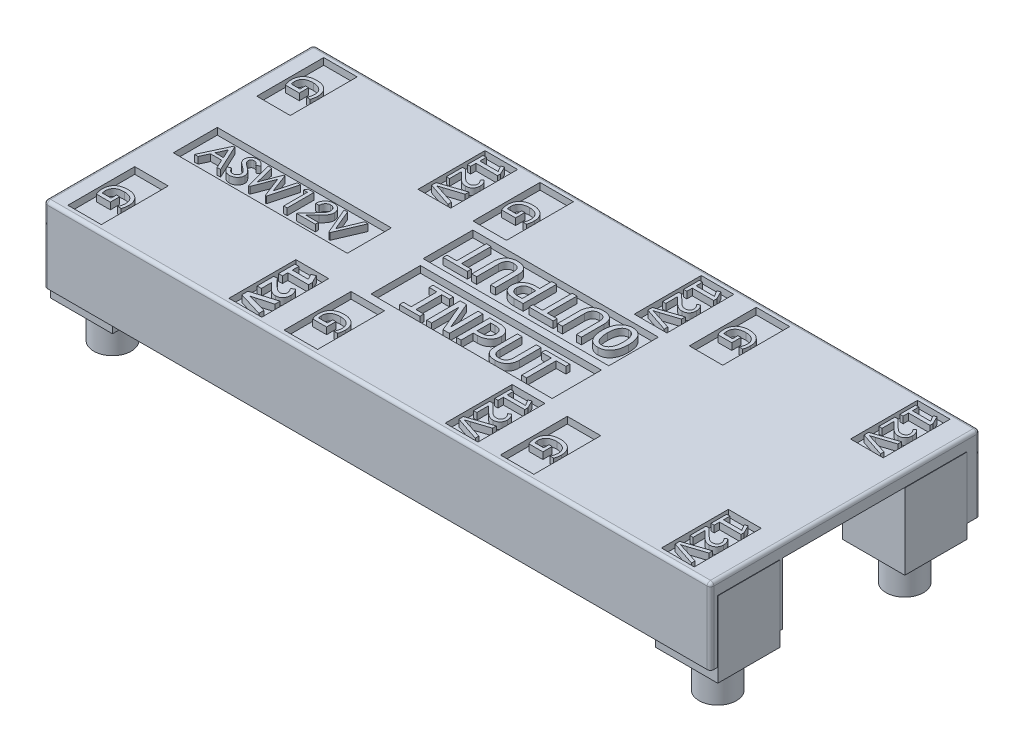
from build123d import *

# Parameters (mm, degrees)
MAIN_START                    = 3.5
SKETCH1_W                     = 99.568
SKETCH1_H                     = 40.259
MAIN_VOLUME_BOSS_DEPTH        = 11.2986
HOLLOW_START                  = 2
SKETCH3_W                     = 98.068
SKETCH3_H                     = 36.259
HOLLOW_OUT_MAIN_DEPTH         = 9.2986
SKETCH4_R                     = 2.794
SCREW_PILLARS_DEPTH           = 16.8
SKETCH5_W                     = 10.794
SKETCH5_H                     = 11.1986002
SKETCH5_W_2                   = 11.285
SKETCH5_H_2                   = 11.1986
USB_SIDE_VERTICAL_BOSS_DEPTH  = 1.5
SKETCH6_W                     = 9.271
SKETCH6_H                     = 9.271
BOSS_FOR_SCREWS_DEPTH         = 11.3
SKETCH7_R                     = 1.524
SCREW_HOLES_DEPTH             = 15.24
FILLET1_R                     = 0.5
SKETCH8_W                     = 6.604
SKETCH8_H                     = 3.302
NUT_HOLDER_CUTOUT_RIGHT_DEPTH = 8.636
SKETCH9_W                     = 6.604
SKETCH9_H                     = 3.302
NUT_HOLDER_CUTOUT_LEFT_DEPTH  = 8.636
SKETCH12_W                    = 27.725374355
SKETCH12_H                    = 7.415905603
SKETCH12_W_2                  = 26
SKETCH12_H_2                  = 6.573189057
SKETCH12_W_3                  = 27.051201118
SKETCH12_H_3                  = 7.366
SKETCH12_W_4                  = 5
SKETCH12_H_4                  = 10
SKETCH12_W_5                  = 4.900121043
SKETCH12_W_6                  = 4.876121043
LETTERING_CUTOUT_DEPTH        = 1
LETTERING_DEPTH               = 1


with BuildPart() as part:
    # Sketch1 → main volume boss (new body)
    with BuildSketch(Plane(origin=(0, 16.7986, 0), x_dir=(1, 0, 0), z_dir=(0, 1, 0)).offset(MAIN_START)):
        with Locations((-17.75984127, 1.235293651)):
            Rectangle(SKETCH1_W, SKETCH1_H)
    extrude(amount=-MAIN_VOLUME_BOSS_DEPTH)

    # Sketch3 → hollow out main (cut)
    with BuildSketch(Plane.XZ.offset(-20.2986).offset(HOLLOW_START)):
        with Locations((-17.00984127, -1.235293651)):
            Rectangle(SKETCH3_W, SKETCH3_H)
    extrude(amount=HOLLOW_OUT_MAIN_DEPTH, mode=Mode.SUBTRACT)

    # Sketch4 → screw pillars (add)
    with BuildSketch(Plane.XZ.offset(-18.2986)):
        with Locations(Location((-62.97184127, 13.234206349, 0), (0, 0, 180))):
            Circle(SKETCH4_R)
        with Locations(Location((-62.97184127, -14.705793651, 0), (0, 0, 180))):
            Circle(SKETCH4_R)
        with Locations(Location((27.45215873, 13.234206349, 0), (0, 0, 180))):
            Circle(SKETCH4_R)
        with Locations(Location((27.45215873, -14.705793651, 0), (0, 0, 180))):
            Circle(SKETCH4_R)
    extrude(amount=SCREW_PILLARS_DEPTH)

    # Sketch5 → USB side vertical boss (add)
    with BuildSketch(Plane(origin=(32.02415873, 0, 0), x_dir=(0, 0, -1), z_dir=(1, 0, 0))):
        with Locations((-13.497206349, 14.6992999)):
            Rectangle(SKETCH5_W, SKETCH5_H)
        with Locations((15.722293651, 14.6993)):
            Rectangle(SKETCH5_W_2, SKETCH5_H_2)
    extrude(amount=-USB_SIDE_VERTICAL_BOSS_DEPTH)

    # Sketch6 → boss for screws (add)
    with BuildSketch(Plane.XZ.offset(-18.2986)):
        with Locations((-62.97184127, 13.234206349)):
            Rectangle(SKETCH6_W, SKETCH6_H)
        with Locations((-62.97184127, -14.705793651)):
            Rectangle(SKETCH6_W, SKETCH6_H)
        with Locations((27.45215873, 13.234206349)):
            Rectangle(SKETCH6_W, SKETCH6_H)
        with Locations((27.45215873, -14.705793651)):
            Rectangle(SKETCH6_W, SKETCH6_H)
    extrude(amount=BOSS_FOR_SCREWS_DEPTH)

    # Sketch7 → screw holes (cut)
    with BuildSketch(Plane.XZ.offset(-1.4986)):
        with Locations(Location((27.45215873, 13.234206349, 0), (0, 0, 270))):
            Circle(SKETCH7_R)
        with Locations(Location((27.45215873, -14.705793651, 0), (0, 0, 270))):
            Circle(SKETCH7_R)
        with Locations(Location((-62.97184127, -14.705793651, 0), (0, 0, 270))):
            Circle(SKETCH7_R)
        with Locations(Location((-62.97184127, 13.234206349, 0), (0, 0, 270))):
            Circle(SKETCH7_R)
    extrude(amount=-SCREW_HOLES_DEPTH, mode=Mode.SUBTRACT)

    # Fillet1
    fillet1_edges = [part.edges().sort_by_distance(p)[0] for p in [
        (32.02415873, 20.2986, -1.235293651),
        (-17.75984127, 20.2986, -21.364793651),
        (32.02415873, 14.6493, 18.894206349),
        (32.02415873, 14.6493, -21.364793651),
        (-67.54384127, 14.6493, -21.364793651),
        (-67.54384127, 14.6493, 18.894206349),
        (-67.54384127, 20.2986, -1.235293651),
        (-17.75984127, 20.2986, 18.894206349),
    ]]
    fillet(fillet1_edges, radius=FILLET1_R)

    # Sketch8 → nut holder cutout right (cut)
    with BuildSketch(Plane.ZY.offset(-22.81665873)):
        with Locations((13.234206349, 10.6496)):
            Rectangle(SKETCH8_W, SKETCH8_H)
        with Locations((-14.705793651, 10.6496)):
            Rectangle(SKETCH8_W, SKETCH8_H)
    extrude(amount=-NUT_HOLDER_CUTOUT_RIGHT_DEPTH, mode=Mode.SUBTRACT)

    # Sketch9 → nut holder cutout left (cut)
    with BuildSketch(Plane(origin=(-58.33634127, 0, 0), x_dir=(0, 0, -1), z_dir=(1, 0, 0))):
        with Locations((14.705793651, 10.6496)):
            Rectangle(SKETCH9_W, SKETCH9_H)
        with Locations((-13.234206349, 10.6496)):
            Rectangle(SKETCH9_W, SKETCH9_H)
    extrude(amount=-NUT_HOLDER_CUTOUT_LEFT_DEPTH, mode=Mode.SUBTRACT)

    # Sketch12 → lettering cutout (cut)
    with BuildSketch(Plane(origin=(0, 20.2986, 0), x_dir=(1, 0, 0), z_dir=(0, 1, 0))):
        with Locations((-17.689934224, 5.46484085)):
            Rectangle(SKETCH12_W, SKETCH12_H)
        with Locations((-50.912936756, 0.07386587)):
            Rectangle(SKETCH12_W_2, SKETCH12_H_2)
        with Locations((-17.352847605, -3.019206349)):
            Rectangle(SKETCH12_W_3, SKETCH12_H_3)
        with Locations((-30.19504127, 15.348793651)):
            Rectangle(SKETCH12_W_4, SKETCH12_H_4)
        with Locations((-62.50384127, -12.878206349)):
            Rectangle(SKETCH12_W_4, SKETCH12_H_4)
        with Locations((-38.486876235, -12.878206349)):
            Rectangle(SKETCH12_W_5, SKETCH12_H_4)
        with Locations((-62.50384127, 15.348793651)):
            Rectangle(SKETCH12_W_4, SKETCH12_H_4)
        with Locations((-38.474876235, 15.348793651)):
            Rectangle(SKETCH12_W_6, SKETCH12_H_4)
        with Locations((-6.166076235, 15.348793651)):
            Rectangle(SKETCH12_W_6, SKETCH12_H_4)
        with Locations((-30.19504127, -12.878206349)):
            Rectangle(SKETCH12_W_4, SKETCH12_H_4)
        with Locations((-6.178076235, -12.878206349)):
            Rectangle(SKETCH12_W_5, SKETCH12_H_4)
        with Locations((2.11375873, 15.348793651)):
            Rectangle(SKETCH12_W_4, SKETCH12_H_4)
        with Locations((26.142723766, 15.348793651)):
            Rectangle(SKETCH12_W_6, SKETCH12_H_4)
        with Locations((2.11375873, -12.878206349)):
            Rectangle(SKETCH12_W_4, SKETCH12_H_4)
        with Locations((26.130723766, -12.878206349)):
            Rectangle(SKETCH12_W_5, SKETCH12_H_4)
    extrude(amount=-LETTERING_CUTOUT_DEPTH, mode=Mode.SUBTRACT)

    # Sketch10 → lettering (add)
    # profile 1 of 41: a face of its own
    with BuildSketch(Plane(origin=(0, 19.2986, 0), x_dir=(1, 0, 0), z_dir=(0, 1, 0))):
        Polygon((-26.229659032, -1.519916577), (-27.389079301, -1.519916577), (-27.389079301, -0.940206443), (-24.345601097, -0.940206443), (-24.345601097, -1.519916577), (-25.505021365, -1.519916577), (-25.505021365, -5.360496215), (-24.345601097, -5.360496215), (-24.345601097, -5.940206349), (-27.389079301, -5.940206349), (-27.389079301, -5.360496215), (-26.229659032, -5.360496215), align=None)
    # profile 2 of 41: a face of its own
    with BuildSketch(Plane(origin=(0, 19.2986, 0), x_dir=(1, 0, 0), z_dir=(0, 1, 0))):
        Polygon((-19.925311325, -5.940206349), (-20.882059495, -5.940206349), (-22.220374688, -2.814074162), (-22.606470695, -1.809771644), (-22.606470695, -4.33694551), (-22.606470695, -5.940206349), (-23.331108362, -5.940206349), (-23.331108362, -0.940206443), (-22.385682655, -0.940206443), (-21.110773259, -3.918014358), (-20.649948992, -5.070641148), (-20.649948992, -2.371365837), (-20.649948992, -0.940206443), (-19.925311325, -0.940206443), align=None)
    # profile 3 of 41: a face of its own
    with BuildSketch(Plane(origin=(0, 19.2986, 0), x_dir=(1, 0, 0), z_dir=(0, 1, 0))):
        with BuildLine():
            add(Edge.make_bspline(
                [(-15.649949086, -2.461945545), (-15.651172696, -2.512596725), (-15.653630917, -2.614354508), (-15.676325141, -2.766267253), (-15.711467025, -2.917365948), (-15.759741337, -3.066657011), (-15.823051302, -3.211934943), (-15.902164459, -3.350610179), (-15.998874827, -3.480077681), (-16.108275059, -3.603093776), (-16.234766815, -3.715526497), (-16.377744953, -3.816829356), (-16.536804513, -3.907017518), (-16.711468238, -3.987273184), (-16.904025749, -4.050252975), (-17.113942841, -4.096988585), (-17.341965454, -4.123711518), (-17.499969678, -4.126943315), (-17.581561369, -4.12861218)],
                knots=[0, 0, 0, 0, 0.84837333, 1.704374698, 2.568122001, 3.446177459, 4.329841521, 5.219461111, 6.115085959, 7.03322926, 7.973947317, 8.94447037, 9.964314875, 11.034235969, 12.160282575, 13.352588404, 14.632904974, 16, 16, 16, 16], degree=3))
            Line((-17.581561369, -4.12861218), (-18.186180923, -4.12861218))
            Line((-18.186180923, -4.12861218), (-18.186180923, -5.940206349))
            Line((-18.186180923, -5.940206349), (-18.91081859, -5.940206349))
            Line((-18.91081859, -5.940206349), (-18.91081859, -0.940206443))
            Line((-18.91081859, -0.940206443), (-17.512494341, -0.940206443))
            add(Edge.make_bspline(
                [(-17.512494341, -0.940206443), (-17.45168909, -0.94085042), (-17.330996291, -0.942128654), (-17.152296396, -0.959240269), (-16.977052473, -0.983345788), (-16.806691163, -1.019382619), (-16.643107768, -1.066661051), (-16.487696907, -1.124370009), (-16.344751166, -1.199640285), (-16.210520991, -1.283985143), (-16.086898895, -1.381350805), (-15.978143945, -1.49434237), (-15.882227168, -1.620216479), (-15.799154912, -1.758677212), (-15.730757919, -1.912070348), (-15.684789931, -2.082027592), (-15.653930478, -2.266834036), (-15.651307333, -2.395383489), (-15.649949086, -2.461945545)],
                knots=[0, 0, 0, 0, 1.071095419, 2.126025337, 3.160633674, 4.187194637, 5.191188192, 6.159546808, 7.102471747, 8.032359578, 8.950543616, 9.867691343, 10.788184798, 11.733733012, 12.707489344, 13.737062018, 14.82826569, 16, 16, 16, 16], degree=3))
        make_face()
        with BuildLine():
            add(Edge.make_bspline(
                [(-16.374586754, -2.500441921), (-16.3753096, -2.461893934), (-16.376718455, -2.38676247), (-16.391862899, -2.277957418), (-16.415711119, -2.175966613), (-16.448195843, -2.080878442), (-16.490307806, -1.992409857), (-16.542963748, -1.911771049), (-16.604495388, -1.837278966), (-16.675945212, -1.770690485), (-16.755909366, -1.712075876), (-16.841987545, -1.659091874), (-16.936954952, -1.616276239), (-17.03950496, -1.581567653), (-17.149071233, -1.552714687), (-17.266716092, -1.534556998), (-17.391031508, -1.521075117), (-17.47659945, -1.520308945), (-17.520420066, -1.519916577)],
                knots=[0, 0, 0, 0, 1.07893025, 2.102875295, 3.069403633, 4.00867391, 4.911619206, 5.805799344, 6.69897942, 7.61127936, 8.532960211, 9.47193309, 10.436783978, 11.442898866, 12.50165651, 13.605056338, 14.773513735, 16, 16, 16, 16], degree=3))
            Line((-17.520420066, -1.519916577), (-18.186180923, -1.519916577))
            Line((-18.186180923, -1.519916577), (-18.186180923, -3.548902046))
            Line((-18.186180923, -3.548902046), (-17.57816463, -3.548902046))
            add(Edge.make_bspline(
                [(-17.57816463, -3.548902046), (-17.531344287, -3.547886525), (-17.440584674, -3.545917972), (-17.308103952, -3.534884886), (-17.183772135, -3.515039943), (-17.068152864, -3.485188037), (-16.960748408, -3.449146788), (-16.861367006, -3.405121259), (-16.770521044, -3.351501882), (-16.687497284, -3.290385338), (-16.612868238, -3.221185464), (-16.549482165, -3.142040944), (-16.494627955, -3.055710071), (-16.450040306, -2.960629105), (-16.416666949, -2.856974579), (-16.391615281, -2.745622394), (-16.376719338, -2.625770744), (-16.375313182, -2.543133035), (-16.374586754, -2.500441921)],
                knots=[0, 0, 0, 0, 1.232805628, 2.389751021, 3.4973379, 4.54330244, 5.530003372, 6.477393866, 7.399377973, 8.301660217, 9.187431021, 10.070466494, 10.963674817, 11.874940633, 12.827061481, 13.825105319, 14.876436953, 16, 16, 16, 16], degree=3))
        make_face(mode=Mode.SUBTRACT)
    # profile 4 of 41: a face of its own
    with BuildSketch(Plane(origin=(0, 19.2986, 0), x_dir=(1, 0, 0), z_dir=(0, 1, 0))):
        with BuildLine():
            add(Edge.make_bspline(
                [(-11.229659314, -4.202208193), (-11.231339021, -4.26943783), (-11.234631683, -4.401225424), (-11.255786595, -4.594195772), (-11.293336442, -4.777140047), (-11.345004998, -4.949867609), (-11.412269161, -5.111226923), (-11.492167269, -5.261267937), (-11.587340478, -5.398615853), (-11.696005537, -5.523547314), (-11.819088816, -5.634812646), (-11.954620166, -5.732827652), (-12.103352262, -5.816758693), (-12.264036311, -5.888707812), (-12.43826498, -5.943345163), (-12.624079033, -5.984814518), (-12.822880527, -6.008304867), (-12.959671529, -6.011188834), (-13.02993102, -6.012670116)],
                knots=[0, 0, 0, 0, 1.11533168, 2.186340517, 3.215329593, 4.209637775, 5.172397981, 6.11082755, 7.024364469, 7.938480506, 8.851566745, 9.770835784, 10.707404611, 11.680049096, 12.68592053, 13.731069016, 14.834616795, 16, 16, 16, 16], degree=3))
            add(Edge.make_bspline(
                [(-13.02993102, -6.012670116), (-13.1066028, -6.011173495), (-13.253888556, -6.0082985), (-13.46608099, -5.985794569), (-13.660162777, -5.947699772), (-13.837226498, -5.894857667), (-13.996717105, -5.826393195), (-14.140686867, -5.74565457), (-14.269662538, -5.652752677), (-14.382813144, -5.546354568), (-14.480757387, -5.427904408), (-14.563430117, -5.297774729), (-14.633384596, -5.157150653), (-14.688374931, -5.005050356), (-14.729799389, -4.842985871), (-14.758875013, -4.671796124), (-14.777629887, -4.491727527), (-14.779452371, -4.368319376), (-14.780383885, -4.305242612)],
                knots=[0, 0, 0, 0, 1.312563004, 2.521420972, 3.648051293, 4.694693708, 5.678954229, 6.613532698, 7.515738083, 8.393474785, 9.265531829, 10.140290115, 11.027490559, 11.949473662, 12.903968408, 13.887719697, 14.920364614, 16, 16, 16, 16], degree=3))
            Line((-14.780383885, -4.305242612), (-14.780383885, -0.940206443))
            Line((-14.780383885, -0.940206443), (-14.055746218, -0.940206443))
            Line((-14.055746218, -0.940206443), (-14.055746218, -4.245233555))
            add(Edge.make_bspline(
                [(-14.055746218, -4.245233555), (-14.055150152, -4.292808437), (-14.053999119, -4.38467795), (-14.043588798, -4.518119079), (-14.02696376, -4.642586711), (-14.003404397, -4.758502717), (-13.972600863, -4.866112262), (-13.92970915, -4.963216616), (-13.88166706, -5.053285709), (-13.821986921, -5.132833985), (-13.7540476, -5.203417868), (-13.676542325, -5.26442367), (-13.590197771, -5.31641335), (-13.494263995, -5.359986264), (-13.387601727, -5.392499146), (-13.270782858, -5.415740686), (-13.142800489, -5.431016682), (-13.053755637, -5.432293601), (-13.007286093, -5.432959982)],
                knots=[0, 0, 0, 0, 1.246642402, 2.407329763, 3.505429403, 4.535490685, 5.505633834, 6.431662104, 7.312644057, 8.175164385, 9.028562083, 9.873549447, 10.752251869, 11.664173984, 12.627739815, 13.667491001, 14.782741197, 16, 16, 16, 16], degree=3))
            add(Edge.make_bspline(
                [(-13.007286093, -5.432959982), (-12.963844844, -5.432204133), (-12.879336941, -5.430733751), (-12.757177321, -5.416161932), (-12.643983854, -5.390849189), (-12.539176184, -5.357547932), (-12.443548836, -5.313016448), (-12.356348179, -5.259293469), (-12.277552943, -5.196074579), (-12.209431682, -5.121105545), (-12.149344004, -5.038148026), (-12.097103646, -4.947001218), (-12.052925362, -4.847951779), (-12.016736214, -4.741024953), (-11.988660282, -4.626220987), (-11.9680921, -4.50364508), (-11.957365288, -4.372990545), (-11.955338614, -4.283369551), (-11.954296982, -4.23730783)],
                knots=[0, 0, 0, 0, 1.143906156, 2.225283924, 3.233450169, 4.19541835, 5.116075032, 6.004390991, 6.887798474, 7.767169552, 8.663955608, 9.581332573, 10.529122189, 11.516238804, 12.550580461, 13.639017649, 14.7865465, 16, 16, 16, 16], degree=3))
            Line((-11.954296982, -4.23730783), (-11.954296982, -0.940206443))
            Line((-11.954296982, -0.940206443), (-11.229659314, -0.940206443))
            Line((-11.229659314, -0.940206443), (-11.229659314, -4.202208193))
        make_face()
    # profile 5 of 41: a face of its own
    with BuildSketch(Plane(origin=(0, 19.2986, 0), x_dir=(1, 0, 0), z_dir=(0, 1, 0))):
        Polygon((-6.954297076, -1.519916577), (-8.403572411, -1.519916577), (-8.403572411, -5.940206349), (-9.128210079, -5.940206349), (-9.128210079, -1.519916577), (-10.577485414, -1.519916577), (-10.577485414, -0.940206443), (-6.954297076, -0.940206443), align=None)
    # profile 6 of 41: a face of its own
    with BuildSketch(Plane(origin=(0, 19.2986, 0), x_dir=(1, 0, 0), z_dir=(0, 1, 0))):
        with BuildLine():
            add(Edge.make_bspline(
                [(-8.921818281, 5.877958506), (-8.919939122, 5.986728543), (-8.916310438, 6.196765011), (-8.886420835, 6.500236688), (-8.839022908, 6.781141156), (-8.769872055, 7.039040092), (-8.683061746, 7.273873059), (-8.585119467, 7.488759096), (-8.471973744, 7.681436044), (-8.345661543, 7.853475376), (-8.205245582, 8.003176855), (-8.055136226, 8.134938026), (-7.890937715, 8.242869096), (-7.717526993, 8.331758642), (-7.535057263, 8.398859877), (-7.34749315, 8.44825456), (-7.154882855, 8.476870041), (-7.025019121, 8.481118436), (-6.95963531, 8.483257419)],
                knots=[0, 0, 0, 0, 1.423032467, 2.74789565, 3.986095212, 5.146946287, 6.235977115, 7.259045831, 8.233104616, 9.154680255, 10.045738054, 10.914074377, 11.761945621, 12.610090105, 13.458637099, 14.300735339, 15.144454002, 16, 16, 16, 16], degree=3))
            add(Edge.make_bspline(
                [(-6.95963531, 8.483257419), (-6.882546719, 8.480977892), (-6.732971517, 8.476554921), (-6.515662227, 8.44537825), (-6.314547469, 8.389311608), (-6.127688787, 8.313556904), (-5.95755385, 8.215278868), (-5.801419911, 8.098876149), (-5.661540468, 7.96203216), (-5.537768071, 7.805468555), (-5.428758733, 7.630498964), (-5.333379459, 7.438186351), (-5.256110462, 7.226585663), (-5.191409523, 6.998818915), (-5.142774555, 6.754452685), (-5.106253676, 6.494811675), (-5.084734378, 6.220263918), (-5.082421351, 6.031982092), (-5.081238571, 5.935703071)],
                knots=[0, 0, 0, 0, 1.030205197, 1.998909912, 2.925271583, 3.814184362, 4.686309791, 5.543784517, 6.410540358, 7.293595139, 8.204656581, 9.161097379, 10.157022635, 11.210838011, 12.322710013, 13.48400651, 14.713431915, 16, 16, 16, 16], degree=3))
            add(Edge.make_bspline(
                [(-5.081238571, 5.935703071), (-5.083270603, 5.828079463), (-5.087199512, 5.619990532), (-5.115146297, 5.318624946), (-5.163221322, 5.039458174), (-5.231157603, 4.782320162), (-5.316283839, 4.547429503), (-5.414871905, 4.333236447), (-5.526542769, 4.139291809), (-5.653868398, 3.967559131), (-5.793951806, 3.817122836), (-5.944824998, 3.687152122), (-6.107659526, 3.578252185), (-6.280506919, 3.490447011), (-6.461448836, 3.422454093), (-6.648003475, 3.373248692), (-6.840247416, 3.344724971), (-6.97011172, 3.340471447), (-7.035495818, 3.338329883)],
                knots=[0, 0, 0, 0, 1.413051082, 2.732116977, 3.969679154, 5.128442986, 6.219508914, 7.246084667, 8.220979251, 9.152645917, 10.046758226, 10.914837981, 11.761492386, 12.612544275, 13.454719919, 14.29491033, 15.141521225, 16, 16, 16, 16], degree=3))
            add(Edge.make_bspline(
                [(-7.035495818, 3.338329883), (-7.112614743, 3.340452283), (-7.262678092, 3.344582196), (-7.47989252, 3.37803836), (-7.682181275, 3.431587649), (-7.868085346, 3.509238815), (-8.038243576, 3.607932513), (-8.194578402, 3.724540838), (-8.334245438, 3.862438865), (-8.461233222, 4.016851633), (-8.570683448, 4.191759048), (-8.666066012, 4.383588791), (-8.74482799, 4.593763792), (-8.810318877, 4.820480596), (-8.861083701, 5.063478723), (-8.894702769, 5.322062132), (-8.918915712, 5.59481729), (-8.920834965, 5.782037449), (-8.921818281, 5.877958506)],
                knots=[0, 0, 0, 0, 1.031565915, 2.007292433, 2.933542939, 3.825562189, 4.694461596, 5.560140367, 6.428041038, 7.314667795, 8.229626955, 9.182805641, 10.177100349, 11.228845024, 12.338260739, 13.495395501, 14.716781815, 16, 16, 16, 16], degree=3))
        make_face()
        with BuildLine():
            add(Edge.make_bspline(
                [(-8.1971806, 5.9266451), (-8.196128807, 5.854170428), (-8.194067778, 5.712153454), (-8.183283752, 5.503553965), (-8.162739439, 5.304479626), (-8.134851445, 5.11543057), (-8.098625207, 4.937156861), (-8.049246572, 4.772255067), (-7.993163529, 4.618622976), (-7.925738794, 4.478356654), (-7.847214481, 4.352246323), (-7.760335985, 4.239351862), (-7.660060783, 4.144045136), (-7.551736115, 4.060793946), (-7.429372912, 3.997042195), (-7.296102513, 3.950249398), (-7.150582144, 3.922903592), (-7.049953673, 3.919693283), (-6.998131687, 3.918040028)],
                knots=[0, 0, 0, 0, 1.323224684, 2.592910887, 3.811929415, 4.975431619, 6.080847083, 7.12955438, 8.115035924, 9.06419821, 9.964747517, 10.823495656, 11.656766287, 12.483602299, 13.309634052, 14.163864548, 15.054420842, 16, 16, 16, 16], degree=3))
            add(Edge.make_bspline(
                [(-6.998131687, 3.918040028), (-6.94778731, 3.919983435), (-6.849594048, 3.923773919), (-6.708215691, 3.953626149), (-6.577865929, 4.002792867), (-6.45926039, 4.071792543), (-6.351333714, 4.157537091), (-6.253646109, 4.257956126), (-6.166026864, 4.372030993), (-6.088992473, 4.499988415), (-6.021651811, 4.640553841), (-5.962513249, 4.792584885), (-5.914201862, 4.956365813), (-5.875402863, 5.130537014), (-5.843213462, 5.312917072), (-5.822846582, 5.502082574), (-5.8082414, 5.696571231), (-5.806673073, 5.828110809), (-5.805876252, 5.894942202)],
                knots=[0, 0, 0, 0, 0.938375319, 1.830236864, 2.681329516, 3.526521267, 4.378544967, 5.244700333, 6.133138318, 7.055481868, 8.025176963, 9.036984759, 10.094880601, 11.206586202, 12.363869853, 13.547026066, 14.753716057, 16, 16, 16, 16], degree=3))
            add(Edge.make_bspline(
                [(-5.805876252, 5.894942202), (-5.8067715, 5.968180527), (-5.808517183, 6.110991237), (-5.821364702, 6.320247131), (-5.841096344, 6.519459926), (-5.870303053, 6.708521518), (-5.908589009, 6.886283833), (-5.955291221, 7.052112333), (-6.013670212, 7.204395891), (-6.079366372, 7.344436815), (-6.157373134, 7.469411133), (-6.242681162, 7.582530111), (-6.342547469, 7.677327706), (-6.450791529, 7.759354525), (-6.570727729, 7.824578924), (-6.702759314, 7.871451563), (-6.846803017, 7.898674057), (-6.9466856, 7.901890563), (-6.998131687, 7.903547274)],
                knots=[0, 0, 0, 0, 1.340763136, 2.614414457, 3.836861922, 5.004679881, 6.114646625, 7.164372586, 8.155062869, 9.097671087, 9.991240131, 10.848152089, 11.683766599, 12.503256002, 13.328782241, 14.17238617, 15.058658899, 16, 16, 16, 16], degree=3))
            add(Edge.make_bspline(
                [(-6.998131687, 7.903547274), (-7.048446281, 7.901482689), (-7.146135489, 7.897474155), (-7.287976675, 7.869394817), (-7.418110613, 7.818465225), (-7.538066541, 7.749869541), (-7.647217841, 7.664480488), (-7.744740175, 7.562911291), (-7.834878489, 7.450034287), (-7.913023893, 7.321855728), (-7.980011346, 7.181302819), (-8.039474479, 7.029678201), (-8.088750171, 6.866380427), (-8.129314959, 6.692812604), (-8.159461454, 6.510425483), (-8.180390627, 6.321417353), (-8.194774491, 6.126140584), (-8.196370025, 5.993851581), (-8.1971806, 5.9266451)],
                knots=[0, 0, 0, 0, 0.936751022, 1.818765843, 2.677461868, 3.527284708, 4.383360161, 5.248016241, 6.143560069, 7.067973536, 8.03599012, 9.039498541, 10.097595286, 11.208955057, 12.356128457, 13.537236666, 14.748847947, 16, 16, 16, 16], degree=3))
        make_face(mode=Mode.SUBTRACT)
    # profile 7 of 41: a face of its own
    with BuildSketch(Plane(origin=(0, 19.2986, 0), x_dir=(1, 0, 0), z_dir=(0, 1, 0))):
        with BuildLine():
            add(Edge.make_bspline(
                [(-13.124716832, 6.672795462), (-13.123037159, 6.74002513), (-13.119744563, 6.871812785), (-13.098589178, 7.064782716), (-13.061041024, 7.247728505), (-13.009366458, 7.420450708), (-12.942123705, 7.581829131), (-12.862148823, 7.731801644), (-12.767414934, 7.869163259), (-12.657947187, 7.992993064), (-12.535395717, 8.104416212), (-12.399380366, 8.201993781), (-12.251934994, 8.287641102), (-12.090633968, 8.357704606), (-11.917185823, 8.414560896), (-11.730594118, 8.455120533), (-11.531514548, 8.47895683), (-11.394711018, 8.481798078), (-11.324445093, 8.483257419)],
                knots=[0, 0, 0, 0, 1.11545786, 2.186587863, 3.215693351, 4.210114022, 5.172983148, 6.111518884, 7.025159153, 7.934670148, 8.847859688, 9.767232725, 10.707020956, 11.671517582, 12.679430306, 13.730812326, 14.834484952, 16, 16, 16, 16], degree=3))
            add(Edge.make_bspline(
                [(-11.324445093, 8.483257419), (-11.247773111, 8.481763094), (-11.100486967, 8.47889251), (-10.888297182, 8.456358185), (-10.694561134, 8.41843639), (-10.517862604, 8.365400373), (-10.359047691, 8.296278458), (-10.213256309, 8.218452965), (-10.086201762, 8.122704207), (-9.972517616, 8.017140082), (-9.874922415, 7.898110398), (-9.790825309, 7.768711448), (-9.720802712, 7.627921712), (-9.667357775, 7.475409096), (-9.625980626, 7.313475052), (-9.595115378, 7.142513459), (-9.576851566, 6.962297439), (-9.57495935, 6.838900775), (-9.573992194, 6.775829883)],
                knots=[0, 0, 0, 0, 1.312780148, 2.521838103, 3.648654808, 4.689287097, 5.67371045, 6.610942702, 7.511907537, 8.389789447, 9.261990759, 10.140395912, 11.027743131, 11.947679175, 12.902331828, 13.887370252, 14.920186005, 16, 16, 16, 16], degree=3))
            Line((-9.573992194, 6.775829883), (-9.573992194, 3.410793651))
            Line((-9.573992194, 3.410793651), (-10.298629876, 3.410793651))
            Line((-10.298629876, 3.410793651), (-10.298629876, 6.715820825))
            add(Edge.make_bspline(
                [(-10.298629876, 6.715820825), (-10.299267774, 6.763389506), (-10.300499589, 6.855247044), (-10.310349968, 6.988824335), (-10.328947971, 7.113052906), (-10.351887968, 7.22915814), (-10.383313913, 7.336365235), (-10.42406616, 7.433888066), (-10.473173093, 7.522856586), (-10.532255037, 7.602412687), (-10.600764515, 7.672699313), (-10.677098867, 7.735301575), (-10.764573248, 7.785652426), (-10.860257632, 7.829245244), (-10.966554537, 7.863437181), (-11.083625198, 7.886217442), (-11.211566523, 7.901635456), (-11.300617355, 7.902891688), (-11.347090021, 7.903547274)],
                knots=[0, 0, 0, 0, 1.247192059, 2.408391177, 3.508355698, 4.538871144, 5.509442038, 6.432012586, 7.30473011, 8.167630731, 9.021404701, 9.872939221, 10.746946132, 11.659270322, 12.626252954, 13.666462575, 14.782204496, 16, 16, 16, 16], degree=3))
            add(Edge.make_bspline(
                [(-11.347090021, 7.903547274), (-11.390535578, 7.902806993), (-11.475051866, 7.901366896), (-11.597519123, 7.886537884), (-11.710917405, 7.861909494), (-11.815699992, 7.827516267), (-11.912046393, 7.784098664), (-11.998789874, 7.728961817), (-12.076881374, 7.664830376), (-12.146209488, 7.591023933), (-12.205762486, 7.50771695), (-12.258663426, 7.417390661), (-12.302831339, 7.31873173), (-12.337295393, 7.211375344), (-12.36582362, 7.096843014), (-12.386252953, 6.974222333), (-12.397019319, 6.84358055), (-12.399040396, 6.753957749), (-12.400079151, 6.7078951)],
                knots=[0, 0, 0, 0, 1.143772585, 2.225024083, 3.242778032, 4.19518877, 5.124762895, 6.018243173, 6.893852039, 7.779892532, 8.676573873, 9.585240319, 10.532919263, 11.516762363, 12.550983242, 13.639293336, 14.786688192, 16, 16, 16, 16], degree=3))
            Line((-12.400079151, 6.7078951), (-12.400079151, 3.410793651))
            Line((-12.400079151, 3.410793651), (-13.124716832, 3.410793651))
            Line((-13.124716832, 3.410793651), (-13.124716832, 6.672795462))
        make_face()
    # profile 8 of 41: a face of its own
    with BuildSketch(Plane(origin=(0, 19.2986, 0), x_dir=(1, 0, 0), z_dir=(0, 1, 0))):
        Polygon((-17.400079151, 3.990503796), (-15.950803789, 3.990503796), (-15.950803789, 8.410793651), (-15.226166107, 8.410793651), (-15.226166107, 3.990503796), (-13.776890745, 3.990503796), (-13.776890745, 3.410793651), (-17.400079151, 3.410793651), align=None)
    # profile 9 of 41: a face of its own
    with BuildSketch(Plane(origin=(0, 19.2986, 0), x_dir=(1, 0, 0), z_dir=(0, 1, 0))):
        with BuildLine():
            add(Edge.make_bspline(
                [(-21.530513934, 4.932532781), (-21.529291716, 4.983184671), (-21.526836292, 5.08494388), (-21.504120885, 5.236845838), (-21.469060796, 5.387986201), (-21.420367403, 5.537447799), (-21.358184389, 5.68332742), (-21.277333486, 5.821027452), (-21.183694301, 5.952091731), (-21.072715152, 6.073514298), (-20.946859182, 6.186647625), (-20.802937228, 6.286571088), (-20.644970549, 6.378349539), (-20.469537101, 6.456017482), (-20.277545542, 6.521524723), (-20.066806331, 6.567272073), (-19.838519842, 6.59437108), (-19.680500904, 6.597555202), (-19.598901615, 6.599199448)],
                knots=[0, 0, 0, 0, 0.848253723, 1.704134409, 2.567759938, 3.445691604, 4.335028397, 5.219043014, 6.115924948, 7.029243722, 7.969829152, 8.945373818, 9.959588698, 11.026757625, 12.15465059, 13.352961647, 14.633097712, 16, 16, 16, 16], degree=3))
            Line((-19.598901615, 6.599199448), (-18.99428205, 6.599199448))
            Line((-18.99428205, 6.599199448), (-18.99428205, 8.410793651))
            Line((-18.99428205, 8.410793651), (-18.269644368, 8.410793651))
            Line((-18.269644368, 8.410793651), (-18.269644368, 3.410793651))
            Line((-18.269644368, 3.410793651), (-19.667968644, 3.410793651))
            add(Edge.make_bspline(
                [(-19.667968644, 3.410793651), (-19.728753876, 3.412085362), (-19.849364431, 3.414648384), (-20.028731487, 3.428947627), (-20.203912147, 3.455821878), (-20.37504061, 3.489558706), (-20.538248235, 3.536991885), (-20.692962462, 3.595743663), (-20.836849516, 3.668638146), (-20.971365371, 3.753041961), (-21.092918705, 3.852365019), (-21.202692648, 3.9640562), (-21.299414376, 4.08937047), (-21.382610662, 4.228428224), (-21.450908581, 4.382195844), (-21.495331085, 4.552808475), (-21.526632385, 4.737395247), (-21.529189748, 4.865961847), (-21.530513934, 4.932532781)],
                knots=[0, 0, 0, 0, 1.070941314, 2.124970487, 3.166787851, 4.191665358, 5.195340343, 6.157184486, 7.102713219, 8.032305993, 8.949186812, 9.861282233, 10.785533845, 11.730782034, 12.710317951, 13.737780056, 14.828637485, 16, 16, 16, 16], degree=3))
        make_face()
        with BuildLine():
            add(Edge.make_bspline(
                [(-20.805876252, 4.971029158), (-20.805201717, 4.932468851), (-20.803887024, 4.857313374), (-20.788088617, 4.748762164), (-20.76658608, 4.646132165), (-20.731872074, 4.551722513), (-20.69026022, 4.462971977), (-20.637514967, 4.382319588), (-20.575974792, 4.308258833), (-20.505604988, 4.240941868), (-20.425470235, 4.182361922), (-20.338667733, 4.129994242), (-20.243537216, 4.086812116), (-20.140949627, 4.052169667), (-20.031394162, 4.023297676), (-19.913746204, 4.005145438), (-19.789431667, 3.991662005), (-19.703863599, 3.990896052), (-19.660042919, 3.990503796)],
                knots=[0, 0, 0, 0, 1.078761559, 2.10254651, 3.066551682, 4.00917676, 4.91198088, 5.806021213, 6.69906164, 7.603534245, 8.52507099, 9.472953756, 10.437653789, 11.443611371, 12.502203477, 13.605430788, 14.773705496, 16, 16, 16, 16], degree=3))
            Line((-19.660042919, 3.990503796), (-18.99428205, 3.990503796))
            Line((-18.99428205, 3.990503796), (-18.99428205, 6.019489303))
            Line((-18.99428205, 6.019489303), (-19.602298354, 6.019489303))
            add(Edge.make_bspline(
                [(-19.602298354, 6.019489303), (-19.649114699, 6.018459266), (-19.739866564, 6.016462576), (-19.872401905, 6.005627781), (-19.996450638, 5.985098129), (-20.112765581, 5.957654981), (-20.219705127, 5.91905169), (-20.32003058, 5.876137002), (-20.411042839, 5.822020439), (-20.494126553, 5.761003245), (-20.568644823, 5.691717899), (-20.632288252, 5.612973781), (-20.685621708, 5.52592857), (-20.730507462, 5.431269475), (-20.763771734, 5.327546579), (-20.788854719, 5.216214019), (-20.803741739, 5.096356774), (-20.805149167, 5.013719861), (-20.805876252, 4.971029158)],
                knots=[0, 0, 0, 0, 1.23244771, 2.38905721, 3.496322526, 4.539574088, 5.529234578, 6.485423454, 7.407139884, 8.30916017, 9.194673811, 10.077452913, 10.965137002, 11.876138252, 12.827982673, 13.825736751, 14.876763155, 16, 16, 16, 16], degree=3))
        make_face(mode=Mode.SUBTRACT)
    # profile 10 of 41: a face of its own
    with BuildSketch(Plane(origin=(0, 19.2986, 0), x_dir=(1, 0, 0), z_dir=(0, 1, 0))):
        with BuildLine():
            add(Edge.make_bspline(
                [(-25.950803789, 6.672795462), (-25.949124116, 6.74002513), (-25.945831519, 6.871812785), (-25.924676135, 7.064782716), (-25.88712798, 7.247728505), (-25.835453414, 7.420450708), (-25.768210662, 7.581829131), (-25.688235779, 7.731801644), (-25.593501891, 7.869163259), (-25.484034143, 7.992993064), (-25.361482673, 8.104416212), (-25.225467323, 8.201993781), (-25.078021951, 8.287641102), (-24.916720924, 8.357704606), (-24.74327278, 8.414560896), (-24.556681074, 8.455120533), (-24.357601504, 8.47895683), (-24.220797975, 8.481798078), (-24.15053205, 8.483257419)],
                knots=[0, 0, 0, 0, 1.11545786, 2.186587863, 3.215693351, 4.210114022, 5.172983148, 6.111518884, 7.025159153, 7.934670148, 8.847859688, 9.767232725, 10.707020956, 11.671517582, 12.679430306, 13.730812326, 14.834484952, 16, 16, 16, 16], degree=3))
            add(Edge.make_bspline(
                [(-24.15053205, 8.483257419), (-24.073860067, 8.481763094), (-23.926573923, 8.47889251), (-23.714384138, 8.456358185), (-23.52064809, 8.41843639), (-23.34394956, 8.365400373), (-23.185134647, 8.296278458), (-23.039343265, 8.218452965), (-22.912288719, 8.122704207), (-22.798604572, 8.017140082), (-22.701009371, 7.898110398), (-22.616912266, 7.768711448), (-22.546889669, 7.627921712), (-22.493444731, 7.475409096), (-22.452067582, 7.313475052), (-22.421202334, 7.142513459), (-22.402938522, 6.962297439), (-22.401046306, 6.838900775), (-22.400079151, 6.775829883)],
                knots=[0, 0, 0, 0, 1.312780148, 2.521838103, 3.648654808, 4.689287097, 5.67371045, 6.610942702, 7.511907537, 8.389789447, 9.261990759, 10.140395912, 11.027743131, 11.947679175, 12.902331828, 13.887370252, 14.920186005, 16, 16, 16, 16], degree=3))
            Line((-22.400079151, 6.775829883), (-22.400079151, 3.410793651))
            Line((-22.400079151, 3.410793651), (-23.124716832, 3.410793651))
            Line((-23.124716832, 3.410793651), (-23.124716832, 6.715820825))
            add(Edge.make_bspline(
                [(-23.124716832, 6.715820825), (-23.125354731, 6.763389506), (-23.126586546, 6.855247044), (-23.136436924, 6.988824335), (-23.155034927, 7.113052906), (-23.177974924, 7.22915814), (-23.20940087, 7.336365235), (-23.250153116, 7.433888066), (-23.299260049, 7.522856586), (-23.358341993, 7.602412687), (-23.426851472, 7.672699313), (-23.503185823, 7.735301575), (-23.590660204, 7.785652426), (-23.686344588, 7.829245244), (-23.792641494, 7.863437181), (-23.909712155, 7.886217442), (-24.03765348, 7.901635456), (-24.126704312, 7.902891688), (-24.173176977, 7.903547274)],
                knots=[0, 0, 0, 0, 1.247192059, 2.408391177, 3.508355698, 4.538871144, 5.509442038, 6.432012586, 7.30473011, 8.167630731, 9.021404701, 9.872939221, 10.746946132, 11.659270322, 12.626252954, 13.666462575, 14.782204496, 16, 16, 16, 16], degree=3))
            add(Edge.make_bspline(
                [(-24.173176977, 7.903547274), (-24.216622535, 7.902806993), (-24.301138822, 7.901366896), (-24.42360608, 7.886537884), (-24.537004362, 7.861909494), (-24.641786948, 7.827516267), (-24.73813335, 7.784098664), (-24.82487683, 7.728961817), (-24.90296833, 7.664830376), (-24.972296444, 7.591023933), (-25.031849442, 7.50771695), (-25.084750382, 7.417390661), (-25.128918296, 7.31873173), (-25.16338235, 7.211375344), (-25.191910577, 7.096843014), (-25.212339909, 6.974222333), (-25.223106275, 6.84358055), (-25.225127352, 6.753957749), (-25.226166107, 6.7078951)],
                knots=[0, 0, 0, 0, 1.143772585, 2.225024083, 3.242778032, 4.19518877, 5.124762895, 6.018243173, 6.893852039, 7.779892532, 8.676573873, 9.585240319, 10.532919263, 11.516762363, 12.550983242, 13.639293336, 14.786688192, 16, 16, 16, 16], degree=3))
            Line((-25.226166107, 6.7078951), (-25.226166107, 3.410793651))
            Line((-25.226166107, 3.410793651), (-25.950803789, 3.410793651))
            Line((-25.950803789, 3.410793651), (-25.950803789, 6.672795462))
        make_face()
    # profile 11 of 41: a face of its own
    with BuildSketch(Plane(origin=(0, 19.2986, 0), x_dir=(1, 0, 0), z_dir=(0, 1, 0))):
        Polygon((-30.226166107, 3.990503796), (-28.776890745, 3.990503796), (-28.776890745, 8.410793651), (-28.052253064, 8.410793651), (-28.052253064, 3.990503796), (-26.602977702, 3.990503796), (-26.602977702, 3.410793651), (-30.226166107, 3.410793651), align=None)
    # profile 12 of 41: a face of its own
    with BuildSketch(Plane(origin=(0, 19.2986, 0), x_dir=(1, 0, 0), z_dir=(0, 1, 0))):
        Polygon((-60.095330365, 2.161155045), (-58.223535493, -1.838844955), (-58.7499778, -1.838844955), (-59.357349595, -0.556793673), (-60.993567544, -0.556793673), (-61.600939339, -1.838844955), (-62.12097139, -1.838844955), (-60.255586775, 2.161155045), align=None)
        Polygon((-60.17545857, 1.286956327), (-60.798054724, -0.095255212), (-59.546452159, -0.095255212), align=None, mode=Mode.SUBTRACT)
    # profile 13 of 41: a face of its own
    with BuildSketch(Plane(origin=(0, 19.2986, 0), x_dir=(1, 0, 0), z_dir=(0, 1, 0))):
        with BuildLine():
            Line((-58.069689339, -1.045575725), (-57.633791903, -0.81320393))
            add(Edge.make_bspline(
                [(-57.633791903, -0.81320393), (-57.602025604, -0.865822353), (-57.541311407, -0.966390737), (-57.441615614, -1.10186829), (-57.342490993, -1.217395038), (-57.242959067, -1.312854333), (-57.141637261, -1.386712818), (-57.039559958, -1.440091888), (-56.936088277, -1.473642408), (-56.866127733, -1.477816854), (-56.83170857, -1.479870596)],
                knots=[0, 0, 0, 0, 1.354943589, 2.589672558, 3.704607527, 4.708856974, 5.624398268, 6.459549776, 7.242129862, 8, 8, 8, 8], degree=3))
            add(Edge.make_bspline(
                [(-56.83170857, -1.479870596), (-56.799576429, -1.478837736), (-56.735931902, -1.476791935), (-56.642418675, -1.459049807), (-56.551873111, -1.432017059), (-56.465864197, -1.393523026), (-56.386403775, -1.346363114), (-56.316257689, -1.290268421), (-56.256740691, -1.226760963), (-56.207684887, -1.156702261), (-56.169232021, -1.0819009), (-56.14092481, -1.004479428), (-56.124311301, -0.924214766), (-56.12209281, -0.870170222), (-56.12097139, -0.842851366)],
                knots=[0, 0, 0, 0, 1.0888553, 2.156709112, 3.216967111, 4.287545289, 5.343926646, 6.34269433, 7.323221176, 8.28571565, 9.233736345, 10.167849744, 11.073870434, 12, 12, 12, 12], degree=3))
            add(Edge.make_bspline(
                [(-56.12097139, -0.842851366), (-56.122542605, -0.811716492), (-56.125717669, -0.748800034), (-56.151201509, -0.655336885), (-56.1926174, -0.562788229), (-56.230928032, -0.505004263), (-56.250779083, -0.475062904)],
                knots=[0, 0, 0, 0, 0.941861274, 1.903286225, 2.913566088, 4, 4, 4, 4], degree=3))
            add(Edge.make_bspline(
                [(-56.250779083, -0.475062904), (-56.267944361, -0.453267769), (-56.304078731, -0.407387157), (-56.36524397, -0.338313183), (-56.436815328, -0.266258781), (-56.518676703, -0.191549012), (-56.609389222, -0.112509856), (-56.710493781, -0.031184119), (-56.821275646, 0.053802618), (-56.898908502, 0.110818367), (-56.939080365, 0.140321711)],
                knots=[0, 0, 0, 0, 0.718593868, 1.512701116, 2.388487339, 3.348232282, 4.383172848, 5.504845107, 6.708858268, 8, 8, 8, 8], degree=3))
            add(Edge.make_bspline(
                [(-56.939080365, 0.140321711), (-56.98004515, 0.170101786), (-57.058645101, 0.227241409), (-57.16938557, 0.311008362), (-57.268675177, 0.388246135), (-57.355752534, 0.459015096), (-57.430627535, 0.523930338), (-57.493142451, 0.582725485), (-57.54517924, 0.633787044), (-57.573142327, 0.668143657), (-57.58571498, 0.683590942)],
                knots=[0, 0, 0, 0, 1.435833971, 2.754963323, 3.936484598, 5.002077172, 5.935979083, 6.744956812, 7.435712417, 8, 8, 8, 8], degree=3))
            add(Edge.make_bspline(
                [(-57.58571498, 0.683590942), (-57.604069355, 0.70730658), (-57.640128, 0.75389786), (-57.685779494, 0.828633289), (-57.725061581, 0.904346831), (-57.757416206, 0.981739546), (-57.782489091, 1.06056419), (-57.79973805, 1.141097197), (-57.811905167, 1.223018671), (-57.812819461, 1.278364432), (-57.813279083, 1.306187096)],
                knots=[0, 0, 0, 0, 1.064105702, 2.090521257, 3.104283852, 4.09061442, 5.065433238, 6.036507983, 7.012940167, 8, 8, 8, 8], degree=3))
            add(Edge.make_bspline(
                [(-57.813279083, 1.306187096), (-57.811831679, 1.349576076), (-57.808965925, 1.435483081), (-57.783356468, 1.56089444), (-57.741855903, 1.680389067), (-57.685208073, 1.793349362), (-57.612869827, 1.897672673), (-57.526826422, 1.991298734), (-57.426612304, 2.072229742), (-57.314901358, 2.140422682), (-57.194490129, 2.195727611), (-57.067668886, 2.235146431), (-56.935975054, 2.259043515), (-56.846497682, 2.262149054), (-56.801259852, 2.263719147)],
                knots=[0, 0, 0, 0, 1.004530234, 1.988896367, 2.951881425, 3.928924249, 4.907494835, 5.884204368, 6.865296418, 7.88218147, 8.909671266, 9.927572845, 10.952225504, 12, 12, 12, 12], degree=3))
            add(Edge.make_bspline(
                [(-56.801259852, 2.263719147), (-56.749894877, 2.26188061), (-56.648166296, 2.258239379), (-56.498208804, 2.23356334), (-56.354812599, 2.189135827), (-56.239322782, 2.140096104), (-56.14960832, 2.089956847), (-56.081755437, 2.044672515), (-56.012209731, 1.993423544), (-55.943173922, 1.93365521), (-55.871957368, 1.868259331), (-55.802206928, 1.793681137), (-55.729508467, 1.714194798), (-55.683173128, 1.656871266), (-55.659432929, 1.627501198)],
                knots=[0, 0, 0, 0, 1.360590218, 2.69465552, 4.010645498, 5.328858611, 6.009843139, 6.729980544, 7.488405022, 8.296451933, 9.147430815, 10.048128915, 10.999946711, 12, 12, 12, 12], degree=3))
            Line((-55.659432929, 1.627501198), (-56.077702159, 1.340642224))
            add(Edge.make_bspline(
                [(-56.077702159, 1.340642224), (-56.099530498, 1.363948982), (-56.141500914, 1.408762027), (-56.203238525, 1.472313773), (-56.261650723, 1.529346923), (-56.31691478, 1.579600569), (-56.367792031, 1.62397092), (-56.415712079, 1.660961799), (-56.459176406, 1.692753779), (-56.513510669, 1.72426314), (-56.580120376, 1.755469541), (-56.662101295, 1.783548144), (-56.74809575, 1.798554431), (-56.806283102, 1.800962603), (-56.83571498, 1.802180686)],
                knots=[0, 0, 0, 0, 1.253377364, 2.409930098, 3.477532466, 4.457083962, 5.341772995, 6.126101147, 6.832963523, 7.453284126, 8.588253012, 9.715448048, 10.844445545, 12, 12, 12, 12], degree=3))
            add(Edge.make_bspline(
                [(-56.83571498, 1.802180686), (-56.867130368, 1.800712579), (-56.928204446, 1.79785846), (-57.015934157, 1.773417734), (-57.09657897, 1.734851101), (-57.167730304, 1.680268988), (-57.226869068, 1.612710947), (-57.270240255, 1.53357526), (-57.295622269, 1.443389624), (-57.298800973, 1.380071122), (-57.30045857, 1.347052481)],
                knots=[0, 0, 0, 0, 1.033513523, 2.009234674, 2.977584268, 3.963375862, 4.942860848, 5.915719707, 6.913112236, 8, 8, 8, 8], degree=3))
            add(Edge.make_bspline(
                [(-57.30045857, 1.347052481), (-57.299812718, 1.325657464), (-57.298522578, 1.28291918), (-57.289046134, 1.21961163), (-57.27152893, 1.158441518), (-57.249331093, 1.098119525), (-57.218261728, 1.038984587), (-57.178693036, 0.980943324), (-57.131721347, 0.922323572), (-57.095672302, 0.885472372), (-57.076900877, 0.86628325)],
                knots=[0, 0, 0, 0, 0.940834015, 1.879392378, 2.805520916, 3.734846727, 4.701501436, 5.734192883, 6.820151034, 8, 8, 8, 8], degree=3))
            add(Edge.make_bspline(
                [(-57.076900877, 0.86628325), (-57.067396106, 0.857341629), (-57.045580661, 0.836818734), (-57.005568793, 0.805392095), (-56.956820569, 0.765991484), (-56.898660165, 0.719259988), (-56.829175136, 0.667734732), (-56.750934588, 0.607973403), (-56.661957465, 0.542666388), (-56.599344015, 0.49688174), (-56.566484211, 0.472853763)],
                knots=[0, 0, 0, 0, 0.485581606, 1.114511607, 1.892484918, 2.819534315, 3.891398566, 5.11240712, 6.484579029, 8, 8, 8, 8], degree=3))
            add(Edge.make_bspline(
                [(-56.566484211, 0.472853763), (-56.521716433, 0.440222635), (-56.435111608, 0.377096583), (-56.312086481, 0.28187924), (-56.201135192, 0.188542823), (-56.099452625, 0.100343622), (-56.010477515, 0.013581855), (-55.932542765, -0.069958553), (-55.864669664, -0.149462183), (-55.792180379, -0.250827088), (-55.719705624, -0.3757926), (-55.654898214, -0.526836902), (-55.616225601, -0.679072765), (-55.610819271, -0.780681356), (-55.608150877, -0.830832135)],
                knots=[0, 0, 0, 0, 1.186540699, 2.295404303, 3.331123753, 4.291760032, 5.17774712, 5.991329992, 6.738459906, 7.414799035, 8.65800623, 9.82461674, 10.926299804, 12, 12, 12, 12], degree=3))
            add(Edge.make_bspline(
                [(-55.608150877, -0.830832135), (-55.609286269, -0.866413381), (-55.611542946, -0.937133828), (-55.627904481, -1.041698537), (-55.655128636, -1.143331847), (-55.694295514, -1.241604596), (-55.743148141, -1.337439098), (-55.803722131, -1.429997508), (-55.875820043, -1.518923162), (-55.956400188, -1.604753405), (-56.045501482, -1.683634746), (-56.141052506, -1.753060728), (-56.242761533, -1.811058808), (-56.349844804, -1.858114182), (-56.461674005, -1.896458468), (-56.579354268, -1.922721097), (-56.702303559, -1.937880274), (-56.785993537, -1.940220402), (-56.828503442, -1.941409058)],
                knots=[0, 0, 0, 0, 0.932646097, 1.853705421, 2.767602683, 3.685675702, 4.622099834, 5.5835355, 6.579838097, 7.620108014, 8.666886363, 9.695041649, 10.711275682, 11.730160242, 12.757671447, 13.80585424, 14.885494678, 16, 16, 16, 16], degree=3))
            add(Edge.make_bspline(
                [(-56.828503442, -1.941409058), (-56.859502147, -1.940720537), (-56.920556778, -1.939364436), (-57.011197117, -1.930762443), (-57.099401457, -1.9142295), (-57.185653394, -1.89285407), (-57.270006757, -1.865635345), (-57.351374468, -1.830817607), (-57.431111484, -1.790824622), (-57.508760399, -1.743996979), (-57.584420227, -1.689165497), (-57.658520935, -1.625516931), (-57.73063209, -1.551932418), (-57.801989829, -1.469367975), (-57.871651422, -1.376894924), (-57.939454238, -1.274999518), (-58.006263997, -1.16401034), (-58.048130849, -1.085832054), (-58.069689339, -1.045575725)],
                knots=[0, 0, 0, 0, 0.916943493, 1.805999526, 2.689245248, 3.568702553, 4.433092864, 5.307568578, 6.183755457, 7.069823058, 7.986358083, 8.944343836, 9.955449961, 11.030835633, 12.170024038, 13.377301724, 14.649494474, 16, 16, 16, 16], degree=3))
        make_face()
    # profile 14 of 41: a face of its own
    with BuildSketch(Plane(origin=(0, 19.2986, 0), x_dir=(1, 0, 0), z_dir=(0, 1, 0))):
        Polygon((-55.095330365, 2.161155045), (-54.58571498, 2.161155045), (-53.852541903, -0.697018032), (-52.766804724, 2.161155045), (-52.599336775, 2.161155045), (-51.521612416, -0.691409058), (-50.784432929, 2.161155045), (-50.274817544, 2.161155045), (-51.36295857, -1.838844955), (-51.537638057, -1.838844955), (-52.6874778, 1.143526839), (-53.844529083, -1.838844955), (-54.017606006, -1.838844955), align=None)
    # profile 15 of 41: a face of its own
    with BuildSketch(Plane(origin=(0, 19.2986, 0), x_dir=(1, 0, 0), z_dir=(0, 1, 0))):
        Polygon((-49.145009852, 2.161155045), (-48.274817544, 2.161155045), (-48.274817544, -1.838844955), (-48.787638057, -1.838844955), (-48.787638057, 1.699616583), (-49.403022672, 1.699616583), align=None)
    # profile 16 of 41: a face of its own
    with BuildSketch(Plane(origin=(0, 19.2986, 0), x_dir=(1, 0, 0), z_dir=(0, 1, 0))):
        with BuildLine():
            Line((-46.229144467, 0.879103763), (-46.736356006, 0.879103763))
            add(Edge.make_bspline(
                [(-46.736356006, 0.879103763), (-46.73397348, 0.930715264), (-46.729313588, 1.03166028), (-46.708621262, 1.178748446), (-46.67510117, 1.317343019), (-46.632791736, 1.448618911), (-46.576352131, 1.570935103), (-46.511232117, 1.686423881), (-46.432617297, 1.792664826), (-46.343778256, 1.889826003), (-46.24734034, 1.978100714), (-46.143669128, 2.054218321), (-46.034516984, 2.119081761), (-45.919862443, 2.172010757), (-45.799480967, 2.212992669), (-45.673715688, 2.242814179), (-45.542165402, 2.260751109), (-45.452490905, 2.262720656), (-45.407029083, 2.263719147)],
                knots=[0, 0, 0, 0, 1.154964179, 2.258951466, 3.315045469, 4.34063582, 5.337653555, 6.322213479, 7.300594401, 8.285733883, 9.262436119, 10.219305053, 11.156568068, 12.097250375, 13.037875795, 13.995471444, 14.983774372, 16, 16, 16, 16], degree=3))
            add(Edge.make_bspline(
                [(-45.407029083, 2.263719147), (-45.359430456, 2.262745485), (-45.266028789, 2.260834892), (-45.130013466, 2.242855973), (-45.001287413, 2.213864981), (-44.879812939, 2.174273707), (-44.765811362, 2.121409045), (-44.659057878, 2.057660092), (-44.560578653, 1.981036154), (-44.469658932, 1.895298751), (-44.389353308, 1.800986902), (-44.316820837, 1.704023118), (-44.256865726, 1.602440863), (-44.206638457, 1.498095051), (-44.167987781, 1.390129275), (-44.140692795, 1.278982905), (-44.124331724, 1.164580418), (-44.122098612, 1.087222649), (-44.12097139, 1.048174275)],
                knots=[0, 0, 0, 0, 1.156722346, 2.269809107, 3.328396062, 4.361258308, 5.3694338, 6.377253737, 7.377324894, 8.397019439, 9.4098266, 10.385180797, 11.337325354, 12.27255833, 13.196816462, 14.119704983, 15.050871513, 16, 16, 16, 16], degree=3))
            add(Edge.make_bspline(
                [(-44.12097139, 1.048174275), (-44.123022594, 0.993552009), (-44.127096901, 0.885055756), (-44.158470328, 0.724541777), (-44.211212734, 0.569197762), (-44.272135259, 0.442706991), (-44.333751044, 0.340462699), (-44.390295427, 0.256069217), (-44.456720448, 0.164814245), (-44.534450626, 0.06730865), (-44.620395091, -0.038678535), (-44.717967896, -0.150413169), (-44.824149016, -0.270157397), (-44.899875739, -0.350787624), (-44.939080365, -0.392530853)],
                knots=[0, 0, 0, 0, 1.155755081, 2.295677249, 3.447123235, 4.6205014, 5.259503175, 5.973005395, 6.77029923, 7.648035671, 8.612336498, 9.658570495, 10.787814065, 12, 12, 12, 12], degree=3))
            Line((-44.939080365, -0.392530853), (-45.923054724, -1.377306494))
            Line((-45.923054724, -1.377306494), (-44.069689339, -1.377306494))
            Line((-44.069689339, -1.377306494), (-44.069689339, -1.838844955))
            Line((-44.069689339, -1.838844955), (-46.890202159, -1.838844955))
            Line((-46.890202159, -1.838844955), (-45.359753442, -0.148941109))
            add(Edge.make_bspline(
                [(-45.359753442, -0.148941109), (-45.323300182, -0.110064116), (-45.25334571, -0.035458456), (-45.154754786, 0.073752251), (-45.065803701, 0.174715846), (-44.986018223, 0.267359442), (-44.917487607, 0.352928268), (-44.858368244, 0.430163459), (-44.809329376, 0.499429732), (-44.758402277, 0.580961901), (-44.707938747, 0.678696801), (-44.665010334, 0.797919656), (-44.639251183, 0.919672053), (-44.635612554, 1.00158084), (-44.633791903, 1.042565301)],
                knots=[0, 0, 0, 0, 1.341560447, 2.574479018, 3.703506985, 4.728875774, 5.651874962, 6.462761537, 7.177175968, 7.787249671, 8.88179658, 9.938774664, 10.968630673, 12, 12, 12, 12], degree=3))
            add(Edge.make_bspline(
                [(-44.633791903, 1.042565301), (-44.634240588, 1.067990509), (-44.635128402, 1.118299433), (-44.64723228, 1.191970818), (-44.664282766, 1.263427963), (-44.690653905, 1.331522051), (-44.722426275, 1.39759276), (-44.762167857, 1.460785982), (-44.809890431, 1.52051553), (-44.862977303, 1.578125283), (-44.921692779, 1.630140364), (-44.983710354, 1.676790285), (-45.049792693, 1.714676089), (-45.118133006, 1.747807887), (-45.190855693, 1.771296165), (-45.266173143, 1.788784395), (-45.34467675, 1.800898845), (-45.398168303, 1.801747645), (-45.42545857, 1.802180686)],
                knots=[0, 0, 0, 0, 0.999432927, 1.977580462, 2.931018689, 3.885672852, 4.844657058, 5.812871023, 6.815890212, 7.849665183, 8.891901864, 9.898878619, 10.897592748, 11.885014695, 12.882178885, 13.896915602, 14.927050508, 16, 16, 16, 16], degree=3))
            add(Edge.make_bspline(
                [(-45.42545857, 1.802180686), (-45.451403289, 1.801648554), (-45.502443363, 1.800601713), (-45.577612506, 1.78980073), (-45.649765576, 1.772214607), (-45.719145978, 1.74782105), (-45.786256222, 1.717726462), (-45.84945535, 1.678738981), (-45.909776332, 1.633384529), (-45.968016625, 1.582480983), (-46.021022009, 1.522760989), (-46.068431389, 1.454932243), (-46.110295741, 1.378920836), (-46.146079479, 1.294859741), (-46.175735211, 1.202528423), (-46.199524933, 1.102039153), (-46.217916688, 0.993348199), (-46.225332639, 0.917889718), (-46.229144467, 0.879103763)],
                knots=[0, 0, 0, 0, 0.911540883, 1.79324023, 2.663162255, 3.518366492, 4.375475705, 5.243419306, 6.122264358, 7.02676621, 7.957780629, 8.921596253, 9.930241338, 11.002848587, 12.128200329, 13.335197372, 14.630280975, 16, 16, 16, 16], degree=3))
        make_face()
    # profile 17 of 41: a face of its own
    with BuildSketch(Plane(origin=(0, 19.2986, 0), x_dir=(1, 0, 0), z_dir=(0, 1, 0))):
        Polygon((-43.761997031, 2.161155045), (-43.24597139, 2.161155045), (-41.969529083, -0.90695393), (-40.693888057, 2.161155045), (-40.172253442, 2.161155045), (-41.887798313, -1.838844955), (-42.052061134, -1.838844955), align=None)
    # profile 18 of 41: a face of its own
    with BuildSketch(Plane(origin=(0, 19.2986, 0), x_dir=(1, 0, 0), z_dir=(0, 1, 0))):
        with BuildLine():
            add(Edge.make_bspline(
                [(-61.133522429, 13.928503796), (-61.099344684, 14.005781608), (-61.031422503, 14.159357492), (-60.969662599, 14.360832243), (-60.934416421, 14.526509816), (-60.915648782, 14.656616773), (-60.903407079, 14.792096621), (-60.902233686, 14.884394395), (-60.901638371, 14.931221187)],
                knots=[0, 0, 0, 0, 1.464330601, 2.910096185, 3.643252908, 4.399959025, 5.188227586, 6, 6, 6, 6], degree=3))
            add(Edge.make_bspline(
                [(-60.901638371, 14.931221187), (-60.902932145, 14.984445393), (-60.9054576, 15.088339335), (-60.927937716, 15.239109715), (-60.962684184, 15.381308954), (-61.013795594, 15.513556211), (-61.077773688, 15.636548165), (-61.152641931, 15.75071041), (-61.241530249, 15.853221169), (-61.340751175, 15.946199185), (-61.451236489, 16.029199277), (-61.572812505, 16.101493065), (-61.705256205, 16.163232735), (-61.847448424, 16.214583731), (-61.998900589, 16.255485812), (-62.158672484, 16.283669711), (-62.325989306, 16.302901625), (-62.440229042, 16.304499521), (-62.498558661, 16.30531539)],
                knots=[0, 0, 0, 0, 1.07383125, 2.096124485, 3.070298713, 4.02338534, 4.950249423, 5.864786912, 6.772474448, 7.682348964, 8.605135898, 9.556349748, 10.532485908, 11.550518582, 12.604692889, 13.695003331, 14.823092702, 16, 16, 16, 16], degree=3))
            add(Edge.make_bspline(
                [(-62.498558661, 16.30531539), (-62.5592726, 16.304487119), (-62.67723757, 16.302877817), (-62.84969672, 16.289209755), (-63.01219728, 16.26598929), (-63.165033089, 16.23331046), (-63.307643745, 16.192548978), (-63.439135365, 16.139807813), (-63.559146085, 16.076039334), (-63.66884148, 16.00310217), (-63.765327919, 15.917851335), (-63.850934979, 15.822912907), (-63.923314468, 15.715950846), (-63.984906087, 15.598421444), (-64.031500218, 15.468426928), (-64.066222541, 15.327387244), (-64.085744769, 15.17391256), (-64.088576827, 15.067748502), (-64.090044168, 15.012742926)],
                knots=[0, 0, 0, 0, 1.243320526, 2.415726445, 3.540355266, 4.602811121, 5.614475227, 6.574453135, 7.498382402, 8.393662059, 9.265660112, 10.128400087, 11.004859636, 11.903741185, 12.83886003, 13.825727115, 14.873468712, 16, 16, 16, 16], degree=3))
            add(Edge.make_bspline(
                [(-64.090044168, 15.012742926), (-64.089608241, 14.992506175), (-64.088702934, 14.9504798), (-64.083956917, 14.885827255), (-64.076958096, 14.818723698), (-64.066825826, 14.751418893), (-64.055312669, 14.685151415), (-64.041149109, 14.621578916), (-64.024281547, 14.562661254), (-64.011112596, 14.52566803), (-64.004899241, 14.508213941)],
                knots=[0, 0, 0, 0, 0.945094064, 1.962710246, 3.026179144, 4.094962389, 5.140426656, 6.16660256, 7.134969076, 8, 8, 8, 8], degree=3))
            Line((-64.004899241, 14.508213941), (-62.698739821, 14.508213941))
            Line((-62.698739821, 14.508213941), (-62.698739821, 15.312561767))
            Line((-62.698739821, 15.312561767), (-62.234971705, 15.312561767))
            Line((-62.234971705, 15.312561767), (-62.234971705, 13.928503796))
            Line((-62.234971705, 13.928503796), (-64.30834127, 13.928503796))
            add(Edge.make_bspline(
                [(-64.30834127, 13.928503796), (-64.327601728, 13.972063188), (-64.366719428, 14.060531653), (-64.415933306, 14.198944231), (-64.458129441, 14.342376284), (-64.493634425, 14.488917068), (-64.520558535, 14.636543428), (-64.539292842, 14.783516534), (-64.551817334, 14.927380243), (-64.553156489, 15.02238014), (-64.553812284, 15.068902346)],
                knots=[0, 0, 0, 0, 0.972423304, 1.974976993, 2.997359869, 4.024843793, 5.052901157, 6.060203398, 7.050066144, 8, 8, 8, 8], degree=3))
            add(Edge.make_bspline(
                [(-64.553812284, 15.068902346), (-64.552356095, 15.137221502), (-64.549511206, 15.270693466), (-64.524099503, 15.465519275), (-64.485002977, 15.650121031), (-64.428690678, 15.824150722), (-64.35635322, 15.98627443), (-64.268780042, 16.136720735), (-64.164966828, 16.274041053), (-64.045466332, 16.398916601), (-63.910609747, 16.510823156), (-63.760136534, 16.60945154), (-63.593346743, 16.692131756), (-63.411907624, 16.762465776), (-63.214978879, 16.817198366), (-63.003199479, 16.856866465), (-62.776568533, 16.880458654), (-62.620596643, 16.883472513), (-62.540225328, 16.885025535)],
                knots=[0, 0, 0, 0, 1.06370665, 2.078114337, 3.054979398, 3.999380594, 4.92145651, 5.815163411, 6.704963933, 7.596415903, 8.501447596, 9.428880987, 10.392157234, 11.395659057, 12.455751986, 13.570903998, 14.748302397, 16, 16, 16, 16], degree=3))
            add(Edge.make_bspline(
                [(-62.540225328, 16.885025535), (-62.46014277, 16.8832712), (-62.303458149, 16.879838775), (-62.075170924, 16.85353585), (-61.859512522, 16.809303414), (-61.657724806, 16.746745068), (-61.469366823, 16.668837885), (-61.295807962, 16.576335925), (-61.136456859, 16.469920816), (-60.99309457, 16.348008451), (-60.864671994, 16.212721018), (-60.752845926, 16.063797557), (-60.655746704, 15.902822948), (-60.577628896, 15.728127912), (-60.515251029, 15.543397064), (-60.469280617, 15.348856827), (-60.443229856, 15.144796882), (-60.439675681, 15.005568598), (-60.437870255, 14.934844375)],
                knots=[0, 0, 0, 0, 1.187685027, 2.323751684, 3.40325322, 4.448706947, 5.452612453, 6.422370454, 7.361444742, 8.289291529, 9.2080357, 10.122578476, 11.046580091, 11.990639292, 12.95512931, 13.935010878, 14.951041083, 16, 16, 16, 16], degree=3))
            add(Edge.make_bspline(
                [(-60.437870255, 14.934844375), (-60.439505551, 14.844763349), (-60.442710037, 14.66824268), (-60.470735899, 14.451099237), (-60.501646899, 14.284012962), (-60.532052422, 14.162873327), (-60.567751372, 14.044136356), (-60.59712801, 13.966990154), (-60.611783299, 13.928503796)],
                knots=[0, 0, 0, 0, 1.577575484, 3.091379944, 3.829084024, 4.554025386, 5.278638522, 6, 6, 6, 6], degree=3))
            Line((-60.611783299, 13.928503796), (-61.133522429, 13.928503796))
        make_face()
    # profile 19 of 41: a face of its own
    with BuildSketch(Plane(origin=(0, 19.2986, 0), x_dir=(1, 0, 0), z_dir=(0, 1, 0))):
        Polygon((-40.428936756, -8.527996204), (-39.841791829, -8.527996204), (-39.841791829, -9.488778813), (-37.470693776, -9.488778813), (-37.920226611, -8.652264094), (-37.333081684, -8.421242581), (-36.745936756, -9.615548741), (-36.745936756, -10.182677364), (-39.841791829, -10.182677364), (-39.841791829, -10.983329538), (-40.428936756, -10.983329538), align=None)
    # profile 20 of 41: a face of its own
    with BuildSketch(Plane(origin=(0, 19.2986, 0), x_dir=(1, 0, 0), z_dir=(0, 1, 0))):
        with BuildLine():
            Line((-40.428936756, -11.677228088), (-39.914350932, -11.677228088))
            Line((-39.914350932, -11.677228088), (-39.054483858, -12.564617581))
            add(Edge.make_bspline(
                [(-39.054483858, -12.564617581), (-39.015546198, -12.604635437), (-38.941092752, -12.681154346), (-38.830442834, -12.786531719), (-38.729909546, -12.881234107), (-38.636763561, -12.963940273), (-38.549267624, -13.035194056), (-38.467585187, -13.097893299), (-38.391166558, -13.152453842), (-38.318668693, -13.197944115), (-38.250130622, -13.236089583), (-38.184116871, -13.265952698), (-38.121284408, -13.289884215), (-38.040353307, -13.312201214), (-37.938061071, -13.327688878), (-37.855780883, -13.330494869), (-37.814307001, -13.331909248)],
                knots=[0, 0, 0, 0, 1.561346149, 2.985479849, 4.272660798, 5.42387168, 6.4681479, 7.427594435, 8.303382019, 9.092890023, 9.820107477, 10.495077279, 11.117492523, 11.698467986, 12.839897307, 14, 14, 14, 14], degree=3))
            add(Edge.make_bspline(
                [(-37.814307001, -13.331909248), (-37.778829413, -13.330424978), (-37.708566318, -13.327485393), (-37.607629962, -13.300588377), (-37.515004254, -13.259746217), (-37.434506581, -13.200805103), (-37.368309315, -13.124964722), (-37.326721725, -13.049110587), (-37.302780285, -12.981331253), (-37.289591857, -12.92598191), (-37.280780092, -12.867089568), (-37.280070338, -12.826531392), (-37.279704872, -12.805647246)],
                knots=[0, 0, 0, 0, 1.258858634, 2.493160028, 3.687168782, 4.839434475, 6.008860189, 7.238366007, 7.888457839, 8.559540058, 9.258280829, 10, 10, 10, 10], degree=3))
            add(Edge.make_bspline(
                [(-37.279704872, -12.805647246), (-37.28094494, -12.769732152), (-37.283389153, -12.698942411), (-37.299236896, -12.594731353), (-37.327070155, -12.494642263), (-37.366086494, -12.398793684), (-37.412936445, -12.305599839), (-37.468519952, -12.215879675), (-37.529967772, -12.127591368), (-37.576451494, -12.072209255), (-37.599965742, -12.044193668)],
                knots=[0, 0, 0, 0, 1.020414048, 2.011267059, 2.986668027, 3.96497488, 4.94697347, 5.946696085, 6.961316025, 8, 8, 8, 8], degree=3))
            Line((-37.599965742, -12.044193668), (-37.157105008, -11.677228088))
            add(Edge.make_bspline(
                [(-37.157105008, -11.677228088), (-37.123064696, -11.718125184), (-37.054971519, -11.799934456), (-36.964814221, -11.932491591), (-36.885518217, -12.072909448), (-36.817168047, -12.220580701), (-36.760197857, -12.374588085), (-36.721785739, -12.536181144), (-36.696208751, -12.703634183), (-36.693788215, -12.817781616), (-36.692559945, -12.875704311)],
                knots=[0, 0, 0, 0, 0.971454549, 1.943267346, 2.923283693, 3.913820143, 4.912922616, 5.916646803, 6.942828335, 8, 8, 8, 8], degree=3))
            add(Edge.make_bspline(
                [(-36.692559945, -12.875704311), (-36.69325296, -12.919943674), (-36.694611811, -13.006687403), (-36.708418806, -13.13350297), (-36.729938724, -13.254238455), (-36.759712628, -13.368429934), (-36.797844211, -13.475518453), (-36.844863819, -13.574663806), (-36.899857013, -13.666013271), (-36.963586611, -13.749166788), (-37.03582502, -13.82380106), (-37.116286839, -13.890454571), (-37.206033678, -13.946821169), (-37.303358123, -13.994986233), (-37.409008546, -14.032142152), (-37.52202087, -14.060040787), (-37.643181551, -14.075610245), (-37.726414997, -14.077969747), (-37.769270316, -14.07918461)],
                knots=[0, 0, 0, 0, 1.159543982, 2.273612478, 3.340218648, 4.372730526, 5.364158888, 6.316220354, 7.245033534, 8.15477373, 9.056889616, 9.96311887, 10.887229459, 11.82933317, 12.804579042, 13.817584039, 14.876315517, 16, 16, 16, 16], degree=3))
            add(Edge.make_bspline(
                [(-37.769270316, -14.07918461), (-37.805153682, -14.078244527), (-37.875969056, -14.076389285), (-37.980658554, -14.065838611), (-38.081431727, -14.046262095), (-38.179150703, -14.020544225), (-38.273662218, -13.986609918), (-38.366913971, -13.946603709), (-38.458302803, -13.898513937), (-38.581912066, -13.826581019), (-38.733699414, -13.716020843), (-38.881748745, -13.590191591), (-39.000176363, -13.475553084), (-39.094820333, -13.383635447), (-39.190129513, -13.284041378), (-39.254418226, -13.215748334), (-39.287173396, -13.180952952)],
                knots=[0, 0, 0, 0, 0.827857832, 1.633767082, 2.423595696, 3.193572288, 3.96226603, 4.737777117, 5.532251898, 6.342816607, 8.035012921, 9.854589679, 10.820694617, 11.836452974, 12.897670405, 14, 14, 14, 14], degree=3))
            Line((-39.287173396, -13.180952952), (-39.788415017, -12.638010697))
            Line((-39.788415017, -12.638010697), (-39.788415017, -14.185938233))
            Line((-39.788415017, -14.185938233), (-40.428936756, -14.185938233))
            Line((-40.428936756, -14.185938233), (-40.428936756, -11.677228088))
        make_face()
    # profile 21 of 41: a face of its own
    with BuildSketch(Plane(origin=(0, 19.2986, 0), x_dir=(1, 0, 0), z_dir=(0, 1, 0))):
        Polygon((-40.428936756, -16.461124827), (-40.428936756, -15.543710878), (-36.745936756, -14.426133885), (-36.745936756, -15.211773831), (-38.963576475, -15.828943215), (-39.690835533, -16.027438233), (-38.921875841, -16.23177134), (-36.745936756, -16.838098559), (-36.745936756, -17.575365769), align=None)
    # profile 22 of 41: a face of its own
    with BuildSketch(Plane(origin=(0, 19.2986, 0), x_dir=(1, 0, 0), z_dir=(0, 1, 0))):
        with BuildLine():
            add(Edge.make_bspline(
                [(-61.133529154, -14.298493364), (-61.099351477, -14.221215706), (-61.031429432, -14.067640129), (-60.969669651, -13.866165781), (-60.934423544, -13.700488539), (-60.915655943, -13.570381843), (-60.903414264, -13.434902265), (-60.902240873, -13.342604676), (-60.90164556, -13.295777978)],
                knots=[0, 0, 0, 0, 1.464330601, 2.910096185, 3.643252908, 4.399959025, 5.188227586, 6, 6, 6, 6], degree=3))
            add(Edge.make_bspline(
                [(-60.90164556, -13.295777978), (-60.902939331, -13.242553878), (-60.90546478, -13.138660144), (-60.927944852, -12.987890065), (-60.96269125, -12.845691111), (-61.013802558, -12.713444118), (-61.077780525, -12.590452411), (-61.152648618, -12.476290394), (-61.241536758, -12.37377984), (-61.340757486, -12.28080201), (-61.451242578, -12.197802083), (-61.572818351, -12.12550844), (-61.705261786, -12.063768894), (-61.847453721, -12.012418001), (-61.998905583, -11.971516001), (-62.158677158, -11.943332159), (-62.325993645, -11.924100283), (-62.440233153, -11.92250239), (-62.498562656, -11.921686523)],
                knots=[0, 0, 0, 0, 1.07383125, 2.096124485, 3.070298713, 4.02338534, 4.950249423, 5.864786912, 6.772474448, 7.682348964, 8.605135898, 9.556349748, 10.532485908, 11.550518582, 12.604692889, 13.695003331, 14.823092702, 16, 16, 16, 16], degree=3))
            add(Edge.make_bspline(
                [(-62.498562656, -11.921686523), (-62.559276473, -11.922514793), (-62.677241207, -11.924124091), (-62.849700012, -11.937792126), (-63.012200248, -11.961012544), (-63.16503575, -11.993691309), (-63.307646122, -12.03445271), (-63.439137478, -12.087193769), (-63.559147958, -12.150962121), (-63.668843134, -12.223899139), (-63.76532938, -12.309149803), (-63.850936269, -12.404088041), (-63.923315613, -12.511049888), (-63.984907108, -12.628579055), (-64.031501147, -12.758573311), (-64.066223401, -12.899612714), (-64.085745589, -13.053087091), (-64.088577641, -13.159250936), (-64.09004498, -13.214256402)],
                knots=[0, 0, 0, 0, 1.243320526, 2.415726445, 3.540355266, 4.602811121, 5.614475227, 6.574453135, 7.498382402, 8.393662059, 9.265660112, 10.128400087, 11.004859636, 11.903741185, 12.83886003, 13.825727115, 14.873468712, 16, 16, 16, 16], degree=3))
            add(Edge.make_bspline(
                [(-64.09004498, -13.214256402), (-64.089609053, -13.234493112), (-64.088703748, -13.276519404), (-64.083957741, -13.341171819), (-64.076958933, -13.408275242), (-64.066826684, -13.475579912), (-64.05531355, -13.541847258), (-64.041150019, -13.605419629), (-64.02428249, -13.664337174), (-64.011113566, -13.701330324), (-64.004900223, -13.718784378)],
                knots=[0, 0, 0, 0, 0.945094064, 1.962710246, 3.026179144, 4.094962389, 5.140426656, 6.16660256, 7.134969076, 8, 8, 8, 8], degree=3))
            Line((-64.004900223, -13.718784378), (-62.698743415, -13.718784378))
            Line((-62.698743415, -13.718784378), (-62.698743415, -12.914438161))
            Line((-62.698743415, -12.914438161), (-62.234976226, -12.914438161))
            Line((-62.234976226, -12.914438161), (-62.234976226, -14.298493364))
            Line((-62.234976226, -14.298493364), (-64.308341645, -14.298493364))
            add(Edge.make_bspline(
                [(-64.308341645, -14.298493364), (-64.327602065, -14.254934059), (-64.366719686, -14.166465771), (-64.415933466, -14.028053469), (-64.458129516, -13.884621703), (-64.49363443, -13.738081212), (-64.520558485, -13.590455148), (-64.539292755, -13.443482335), (-64.551817222, -13.299618914), (-64.553156375, -13.204619207), (-64.553812168, -13.158097094)],
                knots=[0, 0, 0, 0, 0.972423304, 1.974976993, 2.997359869, 4.024843793, 5.052901157, 6.060203398, 7.050066144, 8, 8, 8, 8], degree=3))
            add(Edge.make_bspline(
                [(-64.553812168, -13.158097094), (-64.552355982, -13.089778075), (-64.549511099, -12.956306378), (-64.524099447, -12.761480958), (-64.485002998, -12.576879572), (-64.428690812, -12.402850229), (-64.356353499, -12.240726845), (-64.268780496, -12.090280841), (-64.16496749, -11.952960798), (-64.045467233, -11.828085499), (-63.910610917, -11.716179168), (-63.760138006, -11.617550981), (-63.593348548, -11.534870931), (-63.411909792, -11.464537052), (-63.214981441, -11.409804571), (-63.003202465, -11.370136551), (-62.776571971, -11.34654441), (-62.620600393, -11.343530557), (-62.540229239, -11.341977538)],
                knots=[0, 0, 0, 0, 1.06370665, 2.078114337, 3.054979398, 3.999380594, 4.92145651, 5.815163411, 6.704963933, 7.596415903, 8.501447596, 9.428880987, 10.392157234, 11.395659057, 12.455751986, 13.570903998, 14.748302397, 16, 16, 16, 16], degree=3))
            add(Edge.make_bspline(
                [(-62.540229239, -11.341977538), (-62.460146841, -11.343731869), (-62.303462533, -11.347164287), (-62.075175766, -11.373467159), (-61.859517794, -11.417699507), (-61.657730483, -11.480257728), (-61.469372876, -11.558164756), (-61.295814362, -11.65066653), (-61.136463577, -11.757081426), (-60.993101576, -11.878993547), (-60.864679256, -12.01428071), (-60.752853412, -12.163203873), (-60.655754384, -12.32417816), (-60.577636732, -12.498872847), (-60.51525899, -12.683603326), (-60.46928867, -12.878143173), (-60.443237961, -13.08220271), (-60.439683793, -13.221430715), (-60.437878371, -13.292154797)],
                knots=[0, 0, 0, 0, 1.187685027, 2.323751684, 3.40325322, 4.448706947, 5.452612453, 6.422370454, 7.361444742, 8.289291529, 9.2080357, 10.122578476, 11.046580091, 11.990639292, 12.95512931, 13.935010878, 14.951041083, 16, 16, 16, 16], degree=3))
            add(Edge.make_bspline(
                [(-60.437878371, -13.292154797), (-60.439513663, -13.382235643), (-60.442718143, -13.558755959), (-60.47074395, -13.775898968), (-60.501654888, -13.942984908), (-60.532060349, -14.064124301), (-60.567759228, -14.182861035), (-60.597135808, -14.260007082), (-60.611791067, -14.298493364)],
                knots=[0, 0, 0, 0, 1.577575484, 3.091379944, 3.829084024, 4.554025386, 5.278638522, 6, 6, 6, 6], degree=3))
            Line((-60.611791067, -14.298493364), (-61.133529154, -14.298493364))
        make_face()
    # profile 23 of 41: a face of its own
    with BuildSketch(Plane(origin=(0, 19.2986, 0), x_dir=(1, 0, 0), z_dir=(0, 1, 0))):
        Polygon((-40.428936756, 17.243670462), (-40.428936756, 19.592250173), (-39.948545452, 19.592250173), (-39.948545452, 18.631467564), (-37.226328061, 18.631467564), (-37.760096177, 19.518023044), (-37.333081684, 19.699003796), (-36.745936756, 18.52137789), (-36.745936756, 18.044322636), (-39.948545452, 18.044322636), (-39.948545452, 17.243670462), align=None)
    # profile 24 of 41: a face of its own
    with BuildSketch(Plane(origin=(0, 19.2986, 0), x_dir=(1, 0, 0), z_dir=(0, 1, 0))):
        with BuildLine():
            Line((-40.428936756, 14.094438578), (-40.428936756, 16.4963951))
            Line((-40.428936756, 16.4963951), (-39.97606787, 16.4963951))
            Line((-39.97606787, 16.4963951), (-39.038637617, 15.568972999))
            add(Edge.make_bspline(
                [(-39.038637617, 15.568972999), (-39.001758344, 15.532734447), (-38.931216656, 15.463418315), (-38.828291796, 15.365305791), (-38.732774212, 15.277830302), (-38.643743639, 15.200572672), (-38.560836414, 15.132007304), (-38.481402286, 15.073020822), (-38.406329295, 15.020754128), (-38.334479383, 14.976565843), (-38.265654834, 14.938577604), (-38.197868556, 14.910640294), (-38.133523616, 14.884750914), (-38.047609634, 14.863418181), (-37.937131848, 14.844969325), (-37.847204784, 14.842819445), (-37.800962798, 14.841713941)],
                knots=[0, 0, 0, 0, 1.467717348, 2.807410517, 4.0363466, 5.144006765, 6.153472585, 7.089435693, 7.95191428, 8.749137481, 9.483536977, 10.179891858, 10.829225282, 11.449418579, 12.688448763, 14, 14, 14, 14], degree=3))
            add(Edge.make_bspline(
                [(-37.800962798, 14.841713941), (-37.756354718, 14.843512133), (-37.668542009, 14.847051942), (-37.541078766, 14.873902678), (-37.423816599, 14.91916067), (-37.336685266, 14.973593637), (-37.276071919, 15.026629377), (-37.236769141, 15.073536443), (-37.20161902, 15.124971541), (-37.172169152, 15.182381637), (-37.148970209, 15.245420616), (-37.131168443, 15.314043583), (-37.121397156, 15.388822712), (-37.120195537, 15.440508022), (-37.119574437, 15.467223452)],
                knots=[0, 0, 0, 0, 1.531118492, 3.014065182, 4.450080826, 5.82739247, 6.517155842, 7.207843564, 7.922782385, 8.652921622, 9.417214852, 10.225329491, 11.082697082, 12, 12, 12, 12], degree=3))
            add(Edge.make_bspline(
                [(-37.119574437, 15.467223452), (-37.120911209, 15.504553133), (-37.123552844, 15.578321445), (-37.142836465, 15.686106221), (-37.175783662, 15.788736499), (-37.222484591, 15.885393936), (-37.278684348, 15.977745431), (-37.342281717, 16.066376021), (-37.413407644, 16.151420666), (-37.466362491, 16.203791525), (-37.493212119, 16.230345055)],
                knots=[0, 0, 0, 0, 1.024092753, 2.023740628, 2.993601527, 3.972987048, 4.962099697, 5.957137514, 6.964210054, 8, 8, 8, 8], degree=3))
            Line((-37.493212119, 16.230345055), (-37.172117236, 16.4963951))
            add(Edge.make_bspline(
                [(-37.172117236, 16.4963951), (-37.136928773, 16.461468079), (-37.06677135, 16.391831911), (-36.974512771, 16.275830899), (-36.892457214, 16.152821919), (-36.820546899, 16.022066771), (-36.762355006, 15.88149604), (-36.721470139, 15.729352303), (-36.697301309, 15.566415531), (-36.69416649, 15.453962674), (-36.692559945, 15.396332374)],
                knots=[0, 0, 0, 0, 0.961888715, 1.917777198, 2.87134667, 3.830217176, 4.810480665, 5.817366994, 6.881435296, 8, 8, 8, 8], degree=3))
            add(Edge.make_bspline(
                [(-36.692559945, 15.396332374), (-36.693151423, 15.356801572), (-36.694309312, 15.279415325), (-36.709546544, 15.166280254), (-36.731206261, 15.057949083), (-36.764220077, 14.955796965), (-36.804208677, 14.859030697), (-36.852378882, 14.76876402), (-36.909606811, 14.685530656), (-36.97487764, 14.60965834), (-37.047311536, 14.540342129), (-37.129599488, 14.481536224), (-37.217669186, 14.428195037), (-37.314354211, 14.385476937), (-37.416970225, 14.349549975), (-37.52688015, 14.326380656), (-37.642594697, 14.310527602), (-37.721952237, 14.30882029), (-37.762598215, 14.307945825)],
                knots=[0, 0, 0, 0, 1.100996661, 2.155331913, 3.176573536, 4.176425529, 5.14203239, 6.091935241, 7.022585513, 7.951298274, 8.877680673, 9.809137052, 10.764617512, 11.74258148, 12.749703262, 13.789357616, 14.867735533, 16, 16, 16, 16], degree=3))
            add(Edge.make_bspline(
                [(-37.762598215, 14.307945825), (-37.79709018, 14.308597614), (-37.865110507, 14.309882983), (-37.965296222, 14.319717628), (-38.061277017, 14.337701561), (-38.154101973, 14.36068858), (-38.244451809, 14.392480078), (-38.334154074, 14.430661306), (-38.423672172, 14.476113832), (-38.513448024, 14.528004648), (-38.603366543, 14.587828854), (-38.695387178, 14.653407317), (-38.788027455, 14.727596016), (-38.883243965, 14.808429422), (-38.980873724, 14.897761154), (-39.083503066, 14.993347562), (-39.190252639, 15.097087774), (-39.262511896, 15.169121705), (-39.299683586, 15.206177482)],
                knots=[0, 0, 0, 0, 0.902910228, 1.780595839, 2.631376782, 3.457457344, 4.281419336, 5.135741462, 6.008009302, 6.908011126, 7.848644287, 8.834262115, 9.865162324, 10.954517545, 12.103503259, 13.328977573, 14.625969558, 16, 16, 16, 16], degree=3))
            Line((-39.299683586, 15.206177482), (-39.948545452, 15.855873361))
            Line((-39.948545452, 15.855873361), (-39.948545452, 14.094438578))
            Line((-39.948545452, 14.094438578), (-40.428936756, 14.094438578))
        make_face()
    # profile 25 of 41: a face of its own
    with BuildSketch(Plane(origin=(0, 19.2986, 0), x_dir=(1, 0, 0), z_dir=(0, 1, 0))):
        Polygon((-36.745936756, 10.651634231), (-40.428936756, 11.887641024), (-40.428936756, 12.563191296), (-36.745936756, 13.800866115), (-36.745936756, 13.235405517), (-39.227958495, 12.428081241), (-39.955217553, 12.199561767), (-39.227958495, 11.971876305), (-36.745936756, 11.186236359), align=None)
    # profile 26 of 41: a face of its own
    with BuildSketch(Plane(origin=(0, 19.2986, 0), x_dir=(1, 0, 0), z_dir=(0, 1, 0))):
        Polygon((-8.120136756, 17.243670462), (-8.120136756, 19.592250173), (-7.639745452, 19.592250173), (-7.639745452, 18.631467564), (-4.917528061, 18.631467564), (-5.451296177, 19.518023044), (-5.024281684, 19.699003796), (-4.437136756, 18.52137789), (-4.437136756, 18.044322636), (-7.639745452, 18.044322636), (-7.639745452, 17.243670462), align=None)
    # profile 27 of 41: a face of its own
    with BuildSketch(Plane(origin=(0, 19.2986, 0), x_dir=(1, 0, 0), z_dir=(0, 1, 0))):
        with BuildLine():
            Line((-8.120136756, 14.094438578), (-8.120136756, 16.4963951))
            Line((-8.120136756, 16.4963951), (-7.66726787, 16.4963951))
            Line((-7.66726787, 16.4963951), (-6.729837617, 15.568972999))
            add(Edge.make_bspline(
                [(-6.729837617, 15.568972999), (-6.692958344, 15.532734447), (-6.622416656, 15.463418315), (-6.519491796, 15.365305791), (-6.423974212, 15.277830302), (-6.334943639, 15.200572672), (-6.252036414, 15.132007304), (-6.172602286, 15.073020822), (-6.097529295, 15.020754128), (-6.025679383, 14.976565843), (-5.956854834, 14.938577604), (-5.889068556, 14.910640294), (-5.824723616, 14.884750914), (-5.738809634, 14.863418181), (-5.628331848, 14.844969325), (-5.538404784, 14.842819445), (-5.492162798, 14.841713941)],
                knots=[0, 0, 0, 0, 1.467717348, 2.807410517, 4.0363466, 5.144006765, 6.153472585, 7.089435693, 7.95191428, 8.749137481, 9.483536977, 10.179891858, 10.829225282, 11.449418579, 12.688448763, 14, 14, 14, 14], degree=3))
            add(Edge.make_bspline(
                [(-5.492162798, 14.841713941), (-5.447554718, 14.843512133), (-5.359742009, 14.847051942), (-5.232278766, 14.873902678), (-5.115016599, 14.91916067), (-5.027885266, 14.973593637), (-4.967271919, 15.026629377), (-4.927969141, 15.073536443), (-4.89281902, 15.124971541), (-4.863369152, 15.182381637), (-4.840170209, 15.245420616), (-4.822368443, 15.314043583), (-4.812597156, 15.388822712), (-4.811395537, 15.440508022), (-4.810774437, 15.467223452)],
                knots=[0, 0, 0, 0, 1.531118492, 3.014065182, 4.450080826, 5.82739247, 6.517155842, 7.207843564, 7.922782385, 8.652921622, 9.417214852, 10.225329491, 11.082697082, 12, 12, 12, 12], degree=3))
            add(Edge.make_bspline(
                [(-4.810774437, 15.467223452), (-4.812111209, 15.504553133), (-4.814752844, 15.578321445), (-4.834036465, 15.686106221), (-4.866983662, 15.788736499), (-4.913684591, 15.885393936), (-4.969884348, 15.977745431), (-5.033481717, 16.066376021), (-5.104607644, 16.151420666), (-5.157562491, 16.203791525), (-5.184412119, 16.230345055)],
                knots=[0, 0, 0, 0, 1.024092753, 2.023740628, 2.993601527, 3.972987048, 4.962099697, 5.957137514, 6.964210054, 8, 8, 8, 8], degree=3))
            Line((-5.184412119, 16.230345055), (-4.863317236, 16.4963951))
            add(Edge.make_bspline(
                [(-4.863317236, 16.4963951), (-4.828128773, 16.461468079), (-4.75797135, 16.391831911), (-4.665712771, 16.275830899), (-4.583657214, 16.152821919), (-4.511746899, 16.022066771), (-4.453555006, 15.88149604), (-4.412670139, 15.729352303), (-4.388501309, 15.566415531), (-4.38536649, 15.453962674), (-4.383759945, 15.396332374)],
                knots=[0, 0, 0, 0, 0.961888715, 1.917777198, 2.87134667, 3.830217176, 4.810480665, 5.817366994, 6.881435296, 8, 8, 8, 8], degree=3))
            add(Edge.make_bspline(
                [(-4.383759945, 15.396332374), (-4.384351423, 15.356801572), (-4.385509312, 15.279415325), (-4.400746544, 15.166280254), (-4.422406261, 15.057949083), (-4.455420077, 14.955796965), (-4.495408677, 14.859030697), (-4.543578882, 14.76876402), (-4.600806811, 14.685530656), (-4.66607764, 14.60965834), (-4.738511536, 14.540342129), (-4.820799488, 14.481536224), (-4.908869186, 14.428195037), (-5.005554211, 14.385476937), (-5.108170225, 14.349549975), (-5.21808015, 14.326380656), (-5.333794697, 14.310527602), (-5.413152237, 14.30882029), (-5.453798215, 14.307945825)],
                knots=[0, 0, 0, 0, 1.100996661, 2.155331913, 3.176573536, 4.176425529, 5.14203239, 6.091935241, 7.022585513, 7.951298274, 8.877680673, 9.809137052, 10.764617512, 11.74258148, 12.749703262, 13.789357616, 14.867735533, 16, 16, 16, 16], degree=3))
            add(Edge.make_bspline(
                [(-5.453798215, 14.307945825), (-5.48829018, 14.308597614), (-5.556310507, 14.309882983), (-5.656496222, 14.319717628), (-5.752477017, 14.337701561), (-5.845301973, 14.36068858), (-5.935651809, 14.392480078), (-6.025354074, 14.430661306), (-6.114872172, 14.476113832), (-6.204648024, 14.528004648), (-6.294566543, 14.587828854), (-6.386587178, 14.653407317), (-6.479227455, 14.727596016), (-6.574443965, 14.808429422), (-6.672073724, 14.897761154), (-6.774703066, 14.993347562), (-6.881452639, 15.097087774), (-6.953711896, 15.169121705), (-6.990883586, 15.206177482)],
                knots=[0, 0, 0, 0, 0.902910228, 1.780595839, 2.631376782, 3.457457344, 4.281419336, 5.135741462, 6.008009302, 6.908011126, 7.848644287, 8.834262115, 9.865162324, 10.954517545, 12.103503259, 13.328977573, 14.625969558, 16, 16, 16, 16], degree=3))
            Line((-6.990883586, 15.206177482), (-7.639745452, 15.855873361))
            Line((-7.639745452, 15.855873361), (-7.639745452, 14.094438578))
            Line((-7.639745452, 14.094438578), (-8.120136756, 14.094438578))
        make_face()
    # profile 28 of 41: a face of its own
    with BuildSketch(Plane(origin=(0, 19.2986, 0), x_dir=(1, 0, 0), z_dir=(0, 1, 0))):
        Polygon((-4.437136756, 10.651634231), (-8.120136756, 11.887641024), (-8.120136756, 12.563191296), (-4.437136756, 13.800866115), (-4.437136756, 13.235405517), (-6.919158495, 12.428081241), (-7.646417553, 12.199561767), (-6.919158495, 11.971876305), (-4.437136756, 11.186236359), align=None)
    # profile 29 of 41: a face of its own
    with BuildSketch(Plane(origin=(0, 19.2986, 0), x_dir=(1, 0, 0), z_dir=(0, 1, 0))):
        Polygon((24.188663244, 17.243670462), (24.188663244, 19.592250173), (24.669054548, 19.592250173), (24.669054548, 18.631467564), (27.391271939, 18.631467564), (26.857503823, 19.518023044), (27.284518316, 19.699003796), (27.871663244, 18.52137789), (27.871663244, 18.044322636), (24.669054548, 18.044322636), (24.669054548, 17.243670462), align=None)
    # profile 30 of 41: a face of its own
    with BuildSketch(Plane(origin=(0, 19.2986, 0), x_dir=(1, 0, 0), z_dir=(0, 1, 0))):
        with BuildLine():
            Line((24.188663244, 14.094438578), (24.188663244, 16.4963951))
            Line((24.188663244, 16.4963951), (24.64153213, 16.4963951))
            Line((24.64153213, 16.4963951), (25.578962383, 15.568972999))
            add(Edge.make_bspline(
                [(25.578962383, 15.568972999), (25.615841656, 15.532734447), (25.686383344, 15.463418315), (25.789308204, 15.365305791), (25.884825788, 15.277830302), (25.973856361, 15.200572672), (26.056763586, 15.132007304), (26.136197714, 15.073020822), (26.211270705, 15.020754128), (26.283120617, 14.976565843), (26.351945166, 14.938577604), (26.419731444, 14.910640294), (26.484076384, 14.884750914), (26.569990366, 14.863418181), (26.680468152, 14.844969325), (26.770395216, 14.842819445), (26.816637202, 14.841713941)],
                knots=[0, 0, 0, 0, 1.467717348, 2.807410517, 4.0363466, 5.144006765, 6.153472585, 7.089435693, 7.95191428, 8.749137481, 9.483536977, 10.179891858, 10.829225282, 11.449418579, 12.688448763, 14, 14, 14, 14], degree=3))
            add(Edge.make_bspline(
                [(26.816637202, 14.841713941), (26.861245282, 14.843512133), (26.949057991, 14.847051942), (27.076521234, 14.873902678), (27.193783401, 14.91916067), (27.280914734, 14.973593637), (27.341528081, 15.026629377), (27.380830859, 15.073536443), (27.41598098, 15.124971541), (27.445430848, 15.182381637), (27.468629791, 15.245420616), (27.486431557, 15.314043583), (27.496202844, 15.388822712), (27.497404463, 15.440508022), (27.498025563, 15.467223452)],
                knots=[0, 0, 0, 0, 1.531118492, 3.014065182, 4.450080826, 5.82739247, 6.517155842, 7.207843564, 7.922782385, 8.652921622, 9.417214852, 10.225329491, 11.082697082, 12, 12, 12, 12], degree=3))
            add(Edge.make_bspline(
                [(27.498025563, 15.467223452), (27.496688791, 15.504553133), (27.494047156, 15.578321445), (27.474763535, 15.686106221), (27.441816338, 15.788736499), (27.395115409, 15.885393936), (27.338915652, 15.977745431), (27.275318283, 16.066376021), (27.204192356, 16.151420666), (27.151237509, 16.203791525), (27.124387881, 16.230345055)],
                knots=[0, 0, 0, 0, 1.024092753, 2.023740628, 2.993601527, 3.972987048, 4.962099697, 5.957137514, 6.964210054, 8, 8, 8, 8], degree=3))
            Line((27.124387881, 16.230345055), (27.445482764, 16.4963951))
            add(Edge.make_bspline(
                [(27.445482764, 16.4963951), (27.480671227, 16.461468079), (27.55082865, 16.391831911), (27.643087229, 16.275830899), (27.725142786, 16.152821919), (27.797053101, 16.022066771), (27.855244994, 15.88149604), (27.896129861, 15.729352303), (27.920298691, 15.566415531), (27.92343351, 15.453962674), (27.925040055, 15.396332374)],
                knots=[0, 0, 0, 0, 0.961888715, 1.917777198, 2.87134667, 3.830217176, 4.810480665, 5.817366994, 6.881435296, 8, 8, 8, 8], degree=3))
            add(Edge.make_bspline(
                [(27.925040055, 15.396332374), (27.924448577, 15.356801572), (27.923290688, 15.279415325), (27.908053456, 15.166280254), (27.886393739, 15.057949083), (27.853379923, 14.955796965), (27.813391323, 14.859030697), (27.765221118, 14.76876402), (27.707993189, 14.685530656), (27.64272236, 14.60965834), (27.570288464, 14.540342129), (27.488000512, 14.481536224), (27.399930814, 14.428195037), (27.303245789, 14.385476937), (27.200629775, 14.349549975), (27.09071985, 14.326380656), (26.975005303, 14.310527602), (26.895647763, 14.30882029), (26.855001785, 14.307945825)],
                knots=[0, 0, 0, 0, 1.100996661, 2.155331913, 3.176573536, 4.176425529, 5.14203239, 6.091935241, 7.022585513, 7.951298274, 8.877680673, 9.809137052, 10.764617512, 11.74258148, 12.749703262, 13.789357616, 14.867735533, 16, 16, 16, 16], degree=3))
            add(Edge.make_bspline(
                [(26.855001785, 14.307945825), (26.82050982, 14.308597614), (26.752489493, 14.309882983), (26.652303778, 14.319717628), (26.556322983, 14.337701561), (26.463498027, 14.36068858), (26.373148191, 14.392480078), (26.283445926, 14.430661306), (26.193927828, 14.476113832), (26.104151976, 14.528004648), (26.014233457, 14.587828854), (25.922212822, 14.653407317), (25.829572545, 14.727596016), (25.734356035, 14.808429422), (25.636726276, 14.897761154), (25.534096934, 14.993347562), (25.427347361, 15.097087774), (25.355088104, 15.169121705), (25.317916414, 15.206177482)],
                knots=[0, 0, 0, 0, 0.902910228, 1.780595839, 2.631376782, 3.457457344, 4.281419336, 5.135741462, 6.008009302, 6.908011126, 7.848644287, 8.834262115, 9.865162324, 10.954517545, 12.103503259, 13.328977573, 14.625969558, 16, 16, 16, 16], degree=3))
            Line((25.317916414, 15.206177482), (24.669054548, 15.855873361))
            Line((24.669054548, 15.855873361), (24.669054548, 14.094438578))
            Line((24.669054548, 14.094438578), (24.188663244, 14.094438578))
        make_face()
    # profile 31 of 41: a face of its own
    with BuildSketch(Plane(origin=(0, 19.2986, 0), x_dir=(1, 0, 0), z_dir=(0, 1, 0))):
        Polygon((27.871663244, 10.651634231), (24.188663244, 11.887641024), (24.188663244, 12.563191296), (27.871663244, 13.800866115), (27.871663244, 13.235405517), (25.389641505, 12.428081241), (24.662382447, 12.199561767), (25.389641505, 11.971876305), (27.871663244, 11.186236359), align=None)
    # profile 32 of 41: a face of its own
    with BuildSketch(Plane(origin=(0, 19.2986, 0), x_dir=(1, 0, 0), z_dir=(0, 1, 0))):
        Polygon((-8.120136756, -10.983329538), (-8.120136756, -8.634749827), (-7.639745452, -8.634749827), (-7.639745452, -9.595532436), (-4.917528061, -9.595532436), (-5.451296177, -8.708976956), (-5.024281684, -8.527996204), (-4.437136756, -9.70562211), (-4.437136756, -10.182677364), (-7.639745452, -10.182677364), (-7.639745452, -10.983329538), align=None)
    # profile 33 of 41: a face of its own
    with BuildSketch(Plane(origin=(0, 19.2986, 0), x_dir=(1, 0, 0), z_dir=(0, 1, 0))):
        with BuildLine():
            Line((-8.120136756, -14.132561422), (-8.120136756, -11.7306049))
            Line((-8.120136756, -11.7306049), (-7.66726787, -11.7306049))
            Line((-7.66726787, -11.7306049), (-6.729837617, -12.658027001))
            add(Edge.make_bspline(
                [(-6.729837617, -12.658027001), (-6.692958344, -12.694265553), (-6.622416656, -12.763581685), (-6.519491796, -12.861694209), (-6.423974212, -12.949169698), (-6.334943639, -13.026427328), (-6.252036414, -13.094992696), (-6.172602286, -13.153979178), (-6.097529295, -13.206245872), (-6.025679383, -13.250434157), (-5.956854834, -13.288422396), (-5.889068556, -13.316359706), (-5.824723616, -13.342249086), (-5.738809634, -13.363581819), (-5.628331848, -13.382030675), (-5.538404784, -13.384180555), (-5.492162798, -13.385286059)],
                knots=[0, 0, 0, 0, 1.467717348, 2.807410517, 4.0363466, 5.144006765, 6.153472585, 7.089435693, 7.95191428, 8.749137481, 9.483536977, 10.179891858, 10.829225282, 11.449418579, 12.688448763, 14, 14, 14, 14], degree=3))
            add(Edge.make_bspline(
                [(-5.492162798, -13.385286059), (-5.447554718, -13.383487867), (-5.359742009, -13.379948058), (-5.232278766, -13.353097322), (-5.115016599, -13.30783933), (-5.027885266, -13.253406363), (-4.967271919, -13.200370623), (-4.927969141, -13.153463557), (-4.89281902, -13.102028459), (-4.863369152, -13.044618363), (-4.840170209, -12.981579384), (-4.822368443, -12.912956417), (-4.812597156, -12.838177288), (-4.811395537, -12.786491978), (-4.810774437, -12.759776548)],
                knots=[0, 0, 0, 0, 1.531118492, 3.014065182, 4.450080826, 5.82739247, 6.517155842, 7.207843564, 7.922782385, 8.652921622, 9.417214852, 10.225329491, 11.082697082, 12, 12, 12, 12], degree=3))
            add(Edge.make_bspline(
                [(-4.810774437, -12.759776548), (-4.812111209, -12.722446867), (-4.814752844, -12.648678555), (-4.834036465, -12.540893779), (-4.866983662, -12.438263501), (-4.913684591, -12.341606064), (-4.969884348, -12.249254569), (-5.033481717, -12.160623979), (-5.104607644, -12.075579334), (-5.157562491, -12.023208475), (-5.184412119, -11.996654945)],
                knots=[0, 0, 0, 0, 1.024092753, 2.023740628, 2.993601527, 3.972987048, 4.962099697, 5.957137514, 6.964210054, 8, 8, 8, 8], degree=3))
            Line((-5.184412119, -11.996654945), (-4.863317236, -11.7306049))
            add(Edge.make_bspline(
                [(-4.863317236, -11.7306049), (-4.828128773, -11.765531921), (-4.75797135, -11.835168089), (-4.665712771, -11.951169101), (-4.583657214, -12.074178081), (-4.511746899, -12.204933229), (-4.453555006, -12.34550396), (-4.412670139, -12.497647697), (-4.388501309, -12.660584469), (-4.38536649, -12.773037326), (-4.383759945, -12.830667626)],
                knots=[0, 0, 0, 0, 0.961888715, 1.917777198, 2.87134667, 3.830217176, 4.810480665, 5.817366994, 6.881435296, 8, 8, 8, 8], degree=3))
            add(Edge.make_bspline(
                [(-4.383759945, -12.830667626), (-4.384351423, -12.870198428), (-4.385509312, -12.947584675), (-4.400746544, -13.060719746), (-4.422406261, -13.169050917), (-4.455420077, -13.271203035), (-4.495408677, -13.367969303), (-4.543578882, -13.45823598), (-4.600806811, -13.541469344), (-4.66607764, -13.61734166), (-4.738511536, -13.686657871), (-4.820799488, -13.745463776), (-4.908869186, -13.798804963), (-5.005554211, -13.841523063), (-5.108170225, -13.877450025), (-5.21808015, -13.900619344), (-5.333794697, -13.916472398), (-5.413152237, -13.91817971), (-5.453798215, -13.919054175)],
                knots=[0, 0, 0, 0, 1.100996661, 2.155331913, 3.176573536, 4.176425529, 5.14203239, 6.091935241, 7.022585513, 7.951298274, 8.877680673, 9.809137052, 10.764617512, 11.74258148, 12.749703262, 13.789357616, 14.867735533, 16, 16, 16, 16], degree=3))
            add(Edge.make_bspline(
                [(-5.453798215, -13.919054175), (-5.48829018, -13.918402386), (-5.556310507, -13.917117017), (-5.656496222, -13.907282372), (-5.752477017, -13.889298439), (-5.845301973, -13.86631142), (-5.935651809, -13.834519922), (-6.025354074, -13.796338694), (-6.114872172, -13.750886168), (-6.204648024, -13.698995352), (-6.294566543, -13.639171146), (-6.386587178, -13.573592683), (-6.479227455, -13.499403984), (-6.574443965, -13.418570578), (-6.672073724, -13.329238846), (-6.774703066, -13.233652438), (-6.881452639, -13.129912226), (-6.953711896, -13.057878295), (-6.990883586, -13.020822518)],
                knots=[0, 0, 0, 0, 0.902910228, 1.780595839, 2.631376782, 3.457457344, 4.281419336, 5.135741462, 6.008009302, 6.908011126, 7.848644287, 8.834262115, 9.865162324, 10.954517545, 12.103503259, 13.328977573, 14.625969558, 16, 16, 16, 16], degree=3))
            Line((-6.990883586, -13.020822518), (-7.639745452, -12.371126639))
            Line((-7.639745452, -12.371126639), (-7.639745452, -14.132561422))
            Line((-7.639745452, -14.132561422), (-8.120136756, -14.132561422))
        make_face()
    # profile 34 of 41: a face of its own
    with BuildSketch(Plane(origin=(0, 19.2986, 0), x_dir=(1, 0, 0), z_dir=(0, 1, 0))):
        Polygon((-4.437136756, -17.575365769), (-8.120136756, -16.339358976), (-8.120136756, -15.663808704), (-4.437136756, -14.426133885), (-4.437136756, -14.991594483), (-6.919158495, -15.798918759), (-7.646417553, -16.027438233), (-6.919158495, -16.255123695), (-4.437136756, -17.040763641), align=None)
    # profile 35 of 41: a face of its own
    with BuildSketch(Plane(origin=(0, 19.2986, 0), x_dir=(1, 0, 0), z_dir=(0, 1, 0))):
        Polygon((24.188663244, -10.983329538), (24.188663244, -8.634749827), (24.669054548, -8.634749827), (24.669054548, -9.595532436), (27.391271939, -9.595532436), (26.857503823, -8.708976956), (27.284518316, -8.527996204), (27.871663244, -9.70562211), (27.871663244, -10.182677364), (24.669054548, -10.182677364), (24.669054548, -10.983329538), align=None)
    # profile 36 of 41: a face of its own
    with BuildSketch(Plane(origin=(0, 19.2986, 0), x_dir=(1, 0, 0), z_dir=(0, 1, 0))):
        with BuildLine():
            Line((24.188663244, -14.132561422), (24.188663244, -11.7306049))
            Line((24.188663244, -11.7306049), (24.64153213, -11.7306049))
            Line((24.64153213, -11.7306049), (25.578962383, -12.658027001))
            add(Edge.make_bspline(
                [(25.578962383, -12.658027001), (25.615841656, -12.694265553), (25.686383344, -12.763581685), (25.789308204, -12.861694209), (25.884825788, -12.949169698), (25.973856361, -13.026427328), (26.056763586, -13.094992696), (26.136197714, -13.153979178), (26.211270705, -13.206245872), (26.283120617, -13.250434157), (26.351945166, -13.288422396), (26.419731444, -13.316359706), (26.484076384, -13.342249086), (26.569990366, -13.363581819), (26.680468152, -13.382030675), (26.770395216, -13.384180555), (26.816637202, -13.385286059)],
                knots=[0, 0, 0, 0, 1.467717348, 2.807410517, 4.0363466, 5.144006765, 6.153472585, 7.089435693, 7.95191428, 8.749137481, 9.483536977, 10.179891858, 10.829225282, 11.449418579, 12.688448763, 14, 14, 14, 14], degree=3))
            add(Edge.make_bspline(
                [(26.816637202, -13.385286059), (26.861245282, -13.383487867), (26.949057991, -13.379948058), (27.076521234, -13.353097322), (27.193783401, -13.30783933), (27.280914734, -13.253406363), (27.341528081, -13.200370623), (27.380830859, -13.153463557), (27.41598098, -13.102028459), (27.445430848, -13.044618363), (27.468629791, -12.981579384), (27.486431557, -12.912956417), (27.496202844, -12.838177288), (27.497404463, -12.786491978), (27.498025563, -12.759776548)],
                knots=[0, 0, 0, 0, 1.531118492, 3.014065182, 4.450080826, 5.82739247, 6.517155842, 7.207843564, 7.922782385, 8.652921622, 9.417214852, 10.225329491, 11.082697082, 12, 12, 12, 12], degree=3))
            add(Edge.make_bspline(
                [(27.498025563, -12.759776548), (27.496688791, -12.722446867), (27.494047156, -12.648678555), (27.474763535, -12.540893779), (27.441816338, -12.438263501), (27.395115409, -12.341606064), (27.338915652, -12.249254569), (27.275318283, -12.160623979), (27.204192356, -12.075579334), (27.151237509, -12.023208475), (27.124387881, -11.996654945)],
                knots=[0, 0, 0, 0, 1.024092753, 2.023740628, 2.993601527, 3.972987048, 4.962099697, 5.957137514, 6.964210054, 8, 8, 8, 8], degree=3))
            Line((27.124387881, -11.996654945), (27.445482764, -11.7306049))
            add(Edge.make_bspline(
                [(27.445482764, -11.7306049), (27.480671227, -11.765531921), (27.55082865, -11.835168089), (27.643087229, -11.951169101), (27.725142786, -12.074178081), (27.797053101, -12.204933229), (27.855244994, -12.34550396), (27.896129861, -12.497647697), (27.920298691, -12.660584469), (27.92343351, -12.773037326), (27.925040055, -12.830667626)],
                knots=[0, 0, 0, 0, 0.961888715, 1.917777198, 2.87134667, 3.830217176, 4.810480665, 5.817366994, 6.881435296, 8, 8, 8, 8], degree=3))
            add(Edge.make_bspline(
                [(27.925040055, -12.830667626), (27.924448577, -12.870198428), (27.923290688, -12.947584675), (27.908053456, -13.060719746), (27.886393739, -13.169050917), (27.853379923, -13.271203035), (27.813391323, -13.367969303), (27.765221118, -13.45823598), (27.707993189, -13.541469344), (27.64272236, -13.61734166), (27.570288464, -13.686657871), (27.488000512, -13.745463776), (27.399930814, -13.798804963), (27.303245789, -13.841523063), (27.200629775, -13.877450025), (27.09071985, -13.900619344), (26.975005303, -13.916472398), (26.895647763, -13.91817971), (26.855001785, -13.919054175)],
                knots=[0, 0, 0, 0, 1.100996661, 2.155331913, 3.176573536, 4.176425529, 5.14203239, 6.091935241, 7.022585513, 7.951298274, 8.877680673, 9.809137052, 10.764617512, 11.74258148, 12.749703262, 13.789357616, 14.867735533, 16, 16, 16, 16], degree=3))
            add(Edge.make_bspline(
                [(26.855001785, -13.919054175), (26.82050982, -13.918402386), (26.752489493, -13.917117017), (26.652303778, -13.907282372), (26.556322983, -13.889298439), (26.463498027, -13.86631142), (26.373148191, -13.834519922), (26.283445926, -13.796338694), (26.193927828, -13.750886168), (26.104151976, -13.698995352), (26.014233457, -13.639171146), (25.922212822, -13.573592683), (25.829572545, -13.499403984), (25.734356035, -13.418570578), (25.636726276, -13.329238846), (25.534096934, -13.233652438), (25.427347361, -13.129912226), (25.355088104, -13.057878295), (25.317916414, -13.020822518)],
                knots=[0, 0, 0, 0, 0.902910228, 1.780595839, 2.631376782, 3.457457344, 4.281419336, 5.135741462, 6.008009302, 6.908011126, 7.848644287, 8.834262115, 9.865162324, 10.954517545, 12.103503259, 13.328977573, 14.625969558, 16, 16, 16, 16], degree=3))
            Line((25.317916414, -13.020822518), (24.669054548, -12.371126639))
            Line((24.669054548, -12.371126639), (24.669054548, -14.132561422))
            Line((24.669054548, -14.132561422), (24.188663244, -14.132561422))
        make_face()
    # profile 37 of 41: a face of its own
    with BuildSketch(Plane(origin=(0, 19.2986, 0), x_dir=(1, 0, 0), z_dir=(0, 1, 0))):
        Polygon((27.871663244, -17.575365769), (24.188663244, -16.339358976), (24.188663244, -15.663808704), (27.871663244, -14.426133885), (27.871663244, -14.991594483), (25.389641505, -15.798918759), (24.662382447, -16.027438233), (25.389641505, -16.255123695), (27.871663244, -17.040763641), align=None)
    # profile 38 of 41: a face of its own
    with BuildSketch(Plane(origin=(0, 19.2986, 0), x_dir=(1, 0, 0), z_dir=(0, 1, 0))):
        with BuildLine():
            add(Edge.make_bspline(
                [(-28.824729154, 13.928506636), (-28.790551477, 14.005784294), (-28.722629432, 14.159359871), (-28.660869651, 14.360834219), (-28.625623544, 14.526511461), (-28.606855943, 14.656618157), (-28.594614264, 14.792097735), (-28.593440873, 14.884395324), (-28.59284556, 14.931222022)],
                knots=[0, 0, 0, 0, 1.464330601, 2.910096185, 3.643252908, 4.399959025, 5.188227586, 6, 6, 6, 6], degree=3))
            add(Edge.make_bspline(
                [(-28.59284556, 14.931222022), (-28.594139331, 14.984446122), (-28.59666478, 15.088339856), (-28.619144852, 15.239109935), (-28.65389125, 15.381308889), (-28.705002558, 15.513555882), (-28.768980525, 15.636547589), (-28.843848618, 15.750709606), (-28.932736758, 15.85322016), (-29.031957486, 15.94619799), (-29.142442578, 16.029197917), (-29.264018351, 16.10149156), (-29.396461786, 16.163231106), (-29.538653721, 16.214581999), (-29.690105583, 16.255483999), (-29.849877158, 16.283667841), (-30.017193645, 16.302899717), (-30.131433153, 16.30449761), (-30.189762656, 16.305313477)],
                knots=[0, 0, 0, 0, 1.07383125, 2.096124485, 3.070298713, 4.02338534, 4.950249423, 5.864786912, 6.772474448, 7.682348964, 8.605135898, 9.556349748, 10.532485908, 11.550518582, 12.604692889, 13.695003331, 14.823092702, 16, 16, 16, 16], degree=3))
            add(Edge.make_bspline(
                [(-30.189762656, 16.305313477), (-30.250476473, 16.304485207), (-30.368441207, 16.302875909), (-30.540900012, 16.289207874), (-30.703400248, 16.265987456), (-30.85623575, 16.233308691), (-30.998846122, 16.19254729), (-31.130337478, 16.139806231), (-31.250347958, 16.076037879), (-31.360043134, 16.003100861), (-31.45652938, 15.917850197), (-31.542136269, 15.822911959), (-31.614515613, 15.715950112), (-31.676107108, 15.598420945), (-31.722701147, 15.468426689), (-31.757423401, 15.327387286), (-31.776945589, 15.173912909), (-31.779777641, 15.067749064), (-31.78124498, 15.012743598)],
                knots=[0, 0, 0, 0, 1.243320526, 2.415726445, 3.540355266, 4.602811121, 5.614475227, 6.574453135, 7.498382402, 8.393662059, 9.265660112, 10.128400087, 11.004859636, 11.903741185, 12.83886003, 13.825727115, 14.873468712, 16, 16, 16, 16], degree=3))
            add(Edge.make_bspline(
                [(-31.78124498, 15.012743598), (-31.780809053, 14.992506888), (-31.779903748, 14.950480596), (-31.775157741, 14.885828181), (-31.768158933, 14.818724758), (-31.758026684, 14.751420088), (-31.74651355, 14.685152742), (-31.732350019, 14.621580371), (-31.71548249, 14.562662826), (-31.702313566, 14.525669676), (-31.696100223, 14.508215622)],
                knots=[0, 0, 0, 0, 0.945094064, 1.962710246, 3.026179144, 4.094962389, 5.140426656, 6.16660256, 7.134969076, 8, 8, 8, 8], degree=3))
            Line((-31.696100223, 14.508215622), (-30.389943415, 14.508215622))
            Line((-30.389943415, 14.508215622), (-30.389943415, 15.312561839))
            Line((-30.389943415, 15.312561839), (-29.926176226, 15.312561839))
            Line((-29.926176226, 15.312561839), (-29.926176226, 13.928506636))
            Line((-29.926176226, 13.928506636), (-31.999541645, 13.928506636))
            add(Edge.make_bspline(
                [(-31.999541645, 13.928506636), (-32.018802065, 13.972065941), (-32.057919686, 14.060534229), (-32.107133466, 14.198946531), (-32.149329516, 14.342378297), (-32.18483443, 14.488918788), (-32.211758485, 14.636544852), (-32.230492755, 14.783517665), (-32.243017222, 14.927381086), (-32.244356375, 15.022380793), (-32.245012168, 15.068902906)],
                knots=[0, 0, 0, 0, 0.972423304, 1.974976993, 2.997359869, 4.024843793, 5.052901157, 6.060203398, 7.050066144, 8, 8, 8, 8], degree=3))
            add(Edge.make_bspline(
                [(-32.245012168, 15.068902906), (-32.243555982, 15.137221925), (-32.240711099, 15.270693622), (-32.215299447, 15.465519042), (-32.176202998, 15.650120428), (-32.119890812, 15.824149771), (-32.047553499, 15.986273155), (-31.959980496, 16.136719159), (-31.85616749, 16.274039202), (-31.736667233, 16.398914501), (-31.601810917, 16.510820832), (-31.451338006, 16.609449019), (-31.284548548, 16.692129069), (-31.103109792, 16.762462948), (-30.906181441, 16.817195429), (-30.694402465, 16.856863449), (-30.467771971, 16.88045559), (-30.311800393, 16.883469443), (-30.231429239, 16.885022462)],
                knots=[0, 0, 0, 0, 1.06370665, 2.078114337, 3.054979398, 3.999380594, 4.92145651, 5.815163411, 6.704963933, 7.596415903, 8.501447596, 9.428880987, 10.392157234, 11.395659057, 12.455751986, 13.570903998, 14.748302397, 16, 16, 16, 16], degree=3))
            add(Edge.make_bspline(
                [(-30.231429239, 16.885022462), (-30.151346841, 16.883268131), (-29.994662533, 16.879835713), (-29.766375766, 16.853532841), (-29.550717794, 16.809300493), (-29.348930483, 16.746742272), (-29.160572876, 16.668835244), (-28.987014362, 16.57633347), (-28.827663577, 16.469918574), (-28.684301576, 16.348006453), (-28.555879256, 16.21271929), (-28.444053412, 16.063796127), (-28.346954384, 15.90282184), (-28.268836732, 15.728127153), (-28.20645899, 15.543396674), (-28.16048867, 15.348856827), (-28.134437961, 15.14479729), (-28.130883793, 15.005569285), (-28.129078371, 14.934845203)],
                knots=[0, 0, 0, 0, 1.187685027, 2.323751684, 3.40325322, 4.448706947, 5.452612453, 6.422370454, 7.361444742, 8.289291529, 9.2080357, 10.122578476, 11.046580091, 11.990639292, 12.95512931, 13.935010878, 14.951041083, 16, 16, 16, 16], degree=3))
            add(Edge.make_bspline(
                [(-28.129078371, 14.934845203), (-28.130713663, 14.844764357), (-28.133918143, 14.668244041), (-28.16194395, 14.451101032), (-28.192854888, 14.284015092), (-28.223260349, 14.162875699), (-28.258959228, 14.044138965), (-28.288335808, 13.966992918), (-28.302991067, 13.928506636)],
                knots=[0, 0, 0, 0, 1.577575484, 3.091379944, 3.829084024, 4.554025386, 5.278638522, 6, 6, 6, 6], degree=3))
            Line((-28.302991067, 13.928506636), (-28.824729154, 13.928506636))
        make_face()
    # profile 39 of 41: a face of its own
    with BuildSketch(Plane(origin=(0, 19.2986, 0), x_dir=(1, 0, 0), z_dir=(0, 1, 0))):
        with BuildLine():
            add(Edge.make_bspline(
                [(-28.824729154, -14.298493364), (-28.790551477, -14.221215706), (-28.722629432, -14.067640129), (-28.660869651, -13.866165781), (-28.625623544, -13.700488539), (-28.606855943, -13.570381843), (-28.594614264, -13.434902265), (-28.593440873, -13.342604676), (-28.59284556, -13.295777978)],
                knots=[0, 0, 0, 0, 1.464330601, 2.910096185, 3.643252908, 4.399959025, 5.188227586, 6, 6, 6, 6], degree=3))
            add(Edge.make_bspline(
                [(-28.59284556, -13.295777978), (-28.594139331, -13.242553878), (-28.59666478, -13.138660144), (-28.619144852, -12.987890065), (-28.65389125, -12.845691111), (-28.705002558, -12.713444118), (-28.768980525, -12.590452411), (-28.843848618, -12.476290394), (-28.932736758, -12.37377984), (-29.031957486, -12.28080201), (-29.142442578, -12.197802083), (-29.264018351, -12.12550844), (-29.396461786, -12.063768894), (-29.538653721, -12.012418001), (-29.690105583, -11.971516001), (-29.849877158, -11.943332159), (-30.017193645, -11.924100283), (-30.131433153, -11.92250239), (-30.189762656, -11.921686523)],
                knots=[0, 0, 0, 0, 1.07383125, 2.096124485, 3.070298713, 4.02338534, 4.950249423, 5.864786912, 6.772474448, 7.682348964, 8.605135898, 9.556349748, 10.532485908, 11.550518582, 12.604692889, 13.695003331, 14.823092702, 16, 16, 16, 16], degree=3))
            add(Edge.make_bspline(
                [(-30.189762656, -11.921686523), (-30.250476473, -11.922514793), (-30.368441207, -11.924124091), (-30.540900012, -11.937792126), (-30.703400248, -11.961012544), (-30.85623575, -11.993691309), (-30.998846122, -12.03445271), (-31.130337478, -12.087193769), (-31.250347958, -12.150962121), (-31.360043134, -12.223899139), (-31.45652938, -12.309149803), (-31.542136269, -12.404088041), (-31.614515613, -12.511049888), (-31.676107108, -12.628579055), (-31.722701147, -12.758573311), (-31.757423401, -12.899612714), (-31.776945589, -13.053087091), (-31.779777641, -13.159250936), (-31.78124498, -13.214256402)],
                knots=[0, 0, 0, 0, 1.243320526, 2.415726445, 3.540355266, 4.602811121, 5.614475227, 6.574453135, 7.498382402, 8.393662059, 9.265660112, 10.128400087, 11.004859636, 11.903741185, 12.83886003, 13.825727115, 14.873468712, 16, 16, 16, 16], degree=3))
            add(Edge.make_bspline(
                [(-31.78124498, -13.214256402), (-31.780809053, -13.234493112), (-31.779903748, -13.276519404), (-31.775157741, -13.341171819), (-31.768158933, -13.408275242), (-31.758026684, -13.475579912), (-31.74651355, -13.541847258), (-31.732350019, -13.605419629), (-31.71548249, -13.664337174), (-31.702313566, -13.701330324), (-31.696100223, -13.718784378)],
                knots=[0, 0, 0, 0, 0.945094064, 1.962710246, 3.026179144, 4.094962389, 5.140426656, 6.16660256, 7.134969076, 8, 8, 8, 8], degree=3))
            Line((-31.696100223, -13.718784378), (-30.389943415, -13.718784378))
            Line((-30.389943415, -13.718784378), (-30.389943415, -12.914438161))
            Line((-30.389943415, -12.914438161), (-29.926176226, -12.914438161))
            Line((-29.926176226, -12.914438161), (-29.926176226, -14.298493364))
            Line((-29.926176226, -14.298493364), (-31.999541645, -14.298493364))
            add(Edge.make_bspline(
                [(-31.999541645, -14.298493364), (-32.018802065, -14.254934059), (-32.057919686, -14.166465771), (-32.107133466, -14.028053469), (-32.149329516, -13.884621703), (-32.18483443, -13.738081212), (-32.211758485, -13.590455148), (-32.230492755, -13.443482335), (-32.243017222, -13.299618914), (-32.244356375, -13.204619207), (-32.245012168, -13.158097094)],
                knots=[0, 0, 0, 0, 0.972423304, 1.974976993, 2.997359869, 4.024843793, 5.052901157, 6.060203398, 7.050066144, 8, 8, 8, 8], degree=3))
            add(Edge.make_bspline(
                [(-32.245012168, -13.158097094), (-32.243555982, -13.089778075), (-32.240711099, -12.956306378), (-32.215299447, -12.761480958), (-32.176202998, -12.576879572), (-32.119890812, -12.402850229), (-32.047553499, -12.240726845), (-31.959980496, -12.090280841), (-31.85616749, -11.952960798), (-31.736667233, -11.828085499), (-31.601810917, -11.716179168), (-31.451338006, -11.617550981), (-31.284548548, -11.534870931), (-31.103109792, -11.464537052), (-30.906181441, -11.409804571), (-30.694402465, -11.370136551), (-30.467771971, -11.34654441), (-30.311800393, -11.343530557), (-30.231429239, -11.341977538)],
                knots=[0, 0, 0, 0, 1.06370665, 2.078114337, 3.054979398, 3.999380594, 4.92145651, 5.815163411, 6.704963933, 7.596415903, 8.501447596, 9.428880987, 10.392157234, 11.395659057, 12.455751986, 13.570903998, 14.748302397, 16, 16, 16, 16], degree=3))
            add(Edge.make_bspline(
                [(-30.231429239, -11.341977538), (-30.151346841, -11.343731869), (-29.994662533, -11.347164287), (-29.766375766, -11.373467159), (-29.550717794, -11.417699507), (-29.348930483, -11.480257728), (-29.160572876, -11.558164756), (-28.987014362, -11.65066653), (-28.827663577, -11.757081426), (-28.684301576, -11.878993547), (-28.555879256, -12.01428071), (-28.444053412, -12.163203873), (-28.346954384, -12.32417816), (-28.268836732, -12.498872847), (-28.20645899, -12.683603326), (-28.16048867, -12.878143173), (-28.134437961, -13.08220271), (-28.130883793, -13.221430715), (-28.129078371, -13.292154797)],
                knots=[0, 0, 0, 0, 1.187685027, 2.323751684, 3.40325322, 4.448706947, 5.452612453, 6.422370454, 7.361444742, 8.289291529, 9.2080357, 10.122578476, 11.046580091, 11.990639292, 12.95512931, 13.935010878, 14.951041083, 16, 16, 16, 16], degree=3))
            add(Edge.make_bspline(
                [(-28.129078371, -13.292154797), (-28.130713663, -13.382235643), (-28.133918143, -13.558755959), (-28.16194395, -13.775898968), (-28.192854888, -13.942984908), (-28.223260349, -14.064124301), (-28.258959228, -14.182861035), (-28.288335808, -14.260007082), (-28.302991067, -14.298493364)],
                knots=[0, 0, 0, 0, 1.577575484, 3.091379944, 3.829084024, 4.554025386, 5.278638522, 6, 6, 6, 6], degree=3))
            Line((-28.302991067, -14.298493364), (-28.824729154, -14.298493364))
        make_face()
    # profile 40 of 41: a face of its own
    with BuildSketch(Plane(origin=(0, 19.2986, 0), x_dir=(1, 0, 0), z_dir=(0, 1, 0))):
        with BuildLine():
            add(Edge.make_bspline(
                [(3.484070846, -14.298493364), (3.518248523, -14.221215706), (3.586170568, -14.067640129), (3.647930349, -13.866165781), (3.683176456, -13.700488539), (3.701944057, -13.570381843), (3.714185736, -13.434902265), (3.715359127, -13.342604676), (3.71595444, -13.295777978)],
                knots=[0, 0, 0, 0, 1.464330601, 2.910096185, 3.643252908, 4.399959025, 5.188227586, 6, 6, 6, 6], degree=3))
            add(Edge.make_bspline(
                [(3.71595444, -13.295777978), (3.714660669, -13.242553878), (3.71213522, -13.138660144), (3.689655148, -12.987890065), (3.65490875, -12.845691111), (3.603797442, -12.713444118), (3.539819475, -12.590452411), (3.464951382, -12.476290394), (3.376063242, -12.37377984), (3.276842514, -12.28080201), (3.166357422, -12.197802083), (3.044781649, -12.12550844), (2.912338214, -12.063768894), (2.770146279, -12.012418001), (2.618694417, -11.971516001), (2.458922842, -11.943332159), (2.291606355, -11.924100283), (2.177366847, -11.92250239), (2.119037344, -11.921686523)],
                knots=[0, 0, 0, 0, 1.07383125, 2.096124485, 3.070298713, 4.02338534, 4.950249423, 5.864786912, 6.772474448, 7.682348964, 8.605135898, 9.556349748, 10.532485908, 11.550518582, 12.604692889, 13.695003331, 14.823092702, 16, 16, 16, 16], degree=3))
            add(Edge.make_bspline(
                [(2.119037344, -11.921686523), (2.058323527, -11.922514793), (1.940358793, -11.924124091), (1.767899988, -11.937792126), (1.605399752, -11.961012544), (1.45256425, -11.993691309), (1.309953878, -12.03445271), (1.178462522, -12.087193769), (1.058452042, -12.150962121), (0.948756866, -12.223899139), (0.85227062, -12.309149803), (0.766663731, -12.404088041), (0.694284387, -12.511049888), (0.632692892, -12.628579055), (0.586098853, -12.758573311), (0.551376599, -12.899612714), (0.531854411, -13.053087091), (0.529022359, -13.159250936), (0.52755502, -13.214256402)],
                knots=[0, 0, 0, 0, 1.243320526, 2.415726445, 3.540355266, 4.602811121, 5.614475227, 6.574453135, 7.498382402, 8.393662059, 9.265660112, 10.128400087, 11.004859636, 11.903741185, 12.83886003, 13.825727115, 14.873468712, 16, 16, 16, 16], degree=3))
            add(Edge.make_bspline(
                [(0.52755502, -13.214256402), (0.527990947, -13.234493112), (0.528896252, -13.276519404), (0.533642259, -13.341171819), (0.540641067, -13.408275242), (0.550773316, -13.475579912), (0.56228645, -13.541847258), (0.576449981, -13.605419629), (0.59331751, -13.664337174), (0.606486434, -13.701330324), (0.612699777, -13.718784378)],
                knots=[0, 0, 0, 0, 0.945094064, 1.962710246, 3.026179144, 4.094962389, 5.140426656, 6.16660256, 7.134969076, 8, 8, 8, 8], degree=3))
            Line((0.612699777, -13.718784378), (1.918856585, -13.718784378))
            Line((1.918856585, -13.718784378), (1.918856585, -12.914438161))
            Line((1.918856585, -12.914438161), (2.382623774, -12.914438161))
            Line((2.382623774, -12.914438161), (2.382623774, -14.298493364))
            Line((2.382623774, -14.298493364), (0.309258355, -14.298493364))
            add(Edge.make_bspline(
                [(0.309258355, -14.298493364), (0.289997935, -14.254934059), (0.250880314, -14.166465771), (0.201666534, -14.028053469), (0.159470484, -13.884621703), (0.12396557, -13.738081212), (0.097041515, -13.590455148), (0.078307245, -13.443482335), (0.065782778, -13.299618914), (0.064443625, -13.204619207), (0.063787832, -13.158097094)],
                knots=[0, 0, 0, 0, 0.972423304, 1.974976993, 2.997359869, 4.024843793, 5.052901157, 6.060203398, 7.050066144, 8, 8, 8, 8], degree=3))
            add(Edge.make_bspline(
                [(0.063787832, -13.158097094), (0.065244018, -13.089778075), (0.068088901, -12.956306378), (0.093500553, -12.761480958), (0.132597002, -12.576879572), (0.188909188, -12.402850229), (0.261246501, -12.240726845), (0.348819504, -12.090280841), (0.45263251, -11.952960798), (0.572132767, -11.828085499), (0.706989083, -11.716179168), (0.857461994, -11.617550981), (1.024251452, -11.534870931), (1.205690208, -11.464537052), (1.402618559, -11.409804571), (1.614397535, -11.370136551), (1.841028029, -11.34654441), (1.996999607, -11.343530557), (2.077370761, -11.341977538)],
                knots=[0, 0, 0, 0, 1.06370665, 2.078114337, 3.054979398, 3.999380594, 4.92145651, 5.815163411, 6.704963933, 7.596415903, 8.501447596, 9.428880987, 10.392157234, 11.395659057, 12.455751986, 13.570903998, 14.748302397, 16, 16, 16, 16], degree=3))
            add(Edge.make_bspline(
                [(2.077370761, -11.341977538), (2.157453159, -11.343731869), (2.314137467, -11.347164287), (2.542424234, -11.373467159), (2.758082206, -11.417699507), (2.959869517, -11.480257728), (3.148227124, -11.558164756), (3.321785638, -11.65066653), (3.481136423, -11.757081426), (3.624498424, -11.878993547), (3.752920744, -12.01428071), (3.864746588, -12.163203873), (3.961845616, -12.32417816), (4.039963268, -12.498872847), (4.10234101, -12.683603326), (4.14831133, -12.878143173), (4.174362039, -13.08220271), (4.177916207, -13.221430715), (4.179721629, -13.292154797)],
                knots=[0, 0, 0, 0, 1.187685027, 2.323751684, 3.40325322, 4.448706947, 5.452612453, 6.422370454, 7.361444742, 8.289291529, 9.2080357, 10.122578476, 11.046580091, 11.990639292, 12.95512931, 13.935010878, 14.951041083, 16, 16, 16, 16], degree=3))
            add(Edge.make_bspline(
                [(4.179721629, -13.292154797), (4.178086337, -13.382235643), (4.174881857, -13.558755959), (4.14685605, -13.775898968), (4.115945112, -13.942984908), (4.085539651, -14.064124301), (4.049840772, -14.182861035), (4.020464192, -14.260007082), (4.005808933, -14.298493364)],
                knots=[0, 0, 0, 0, 1.577575484, 3.091379944, 3.829084024, 4.554025386, 5.278638522, 6, 6, 6, 6], degree=3))
            Line((4.005808933, -14.298493364), (3.484070846, -14.298493364))
        make_face()
    # profile 41 of 41: a face of its own
    with BuildSketch(Plane(origin=(0, 19.2986, 0), x_dir=(1, 0, 0), z_dir=(0, 1, 0))):
        with BuildLine():
            add(Edge.make_bspline(
                [(3.484070846, 13.928506636), (3.518248523, 14.005784294), (3.586170568, 14.159359871), (3.647930349, 14.360834219), (3.683176456, 14.526511461), (3.701944057, 14.656618157), (3.714185736, 14.792097735), (3.715359127, 14.884395324), (3.71595444, 14.931222022)],
                knots=[0, 0, 0, 0, 1.464330601, 2.910096185, 3.643252908, 4.399959025, 5.188227586, 6, 6, 6, 6], degree=3))
            add(Edge.make_bspline(
                [(3.71595444, 14.931222022), (3.714660669, 14.984446122), (3.71213522, 15.088339856), (3.689655148, 15.239109935), (3.65490875, 15.381308889), (3.603797442, 15.513555882), (3.539819475, 15.636547589), (3.464951382, 15.750709606), (3.376063242, 15.85322016), (3.276842514, 15.94619799), (3.166357422, 16.029197917), (3.044781649, 16.10149156), (2.912338214, 16.163231106), (2.770146279, 16.214581999), (2.618694417, 16.255483999), (2.458922842, 16.283667841), (2.291606355, 16.302899717), (2.177366847, 16.30449761), (2.119037344, 16.305313477)],
                knots=[0, 0, 0, 0, 1.07383125, 2.096124485, 3.070298713, 4.02338534, 4.950249423, 5.864786912, 6.772474448, 7.682348964, 8.605135898, 9.556349748, 10.532485908, 11.550518582, 12.604692889, 13.695003331, 14.823092702, 16, 16, 16, 16], degree=3))
            add(Edge.make_bspline(
                [(2.119037344, 16.305313477), (2.058323527, 16.304485207), (1.940358793, 16.302875909), (1.767899988, 16.289207874), (1.605399752, 16.265987456), (1.45256425, 16.233308691), (1.309953878, 16.19254729), (1.178462522, 16.139806231), (1.058452042, 16.076037879), (0.948756866, 16.003100861), (0.85227062, 15.917850197), (0.766663731, 15.822911959), (0.694284387, 15.715950112), (0.632692892, 15.598420945), (0.586098853, 15.468426689), (0.551376599, 15.327387286), (0.531854411, 15.173912909), (0.529022359, 15.067749064), (0.52755502, 15.012743598)],
                knots=[0, 0, 0, 0, 1.243320526, 2.415726445, 3.540355266, 4.602811121, 5.614475227, 6.574453135, 7.498382402, 8.393662059, 9.265660112, 10.128400087, 11.004859636, 11.903741185, 12.83886003, 13.825727115, 14.873468712, 16, 16, 16, 16], degree=3))
            add(Edge.make_bspline(
                [(0.52755502, 15.012743598), (0.527990947, 14.992506888), (0.528896252, 14.950480596), (0.533642259, 14.885828181), (0.540641067, 14.818724758), (0.550773316, 14.751420088), (0.56228645, 14.685152742), (0.576449981, 14.621580371), (0.59331751, 14.562662826), (0.606486434, 14.525669676), (0.612699777, 14.508215622)],
                knots=[0, 0, 0, 0, 0.945094064, 1.962710246, 3.026179144, 4.094962389, 5.140426656, 6.16660256, 7.134969076, 8, 8, 8, 8], degree=3))
            Line((0.612699777, 14.508215622), (1.918856585, 14.508215622))
            Line((1.918856585, 14.508215622), (1.918856585, 15.312561839))
            Line((1.918856585, 15.312561839), (2.382623774, 15.312561839))
            Line((2.382623774, 15.312561839), (2.382623774, 13.928506636))
            Line((2.382623774, 13.928506636), (0.309258355, 13.928506636))
            add(Edge.make_bspline(
                [(0.309258355, 13.928506636), (0.289997935, 13.972065941), (0.250880314, 14.060534229), (0.201666534, 14.198946531), (0.159470484, 14.342378297), (0.12396557, 14.488918788), (0.097041515, 14.636544852), (0.078307245, 14.783517665), (0.065782778, 14.927381086), (0.064443625, 15.022380793), (0.063787832, 15.068902906)],
                knots=[0, 0, 0, 0, 0.972423304, 1.974976993, 2.997359869, 4.024843793, 5.052901157, 6.060203398, 7.050066144, 8, 8, 8, 8], degree=3))
            add(Edge.make_bspline(
                [(0.063787832, 15.068902906), (0.065244018, 15.137221925), (0.068088901, 15.270693622), (0.093500553, 15.465519042), (0.132597002, 15.650120428), (0.188909188, 15.824149771), (0.261246501, 15.986273155), (0.348819504, 16.136719159), (0.45263251, 16.274039202), (0.572132767, 16.398914501), (0.706989083, 16.510820832), (0.857461994, 16.609449019), (1.024251452, 16.692129069), (1.205690208, 16.762462948), (1.402618559, 16.817195429), (1.614397535, 16.856863449), (1.841028029, 16.88045559), (1.996999607, 16.883469443), (2.077370761, 16.885022462)],
                knots=[0, 0, 0, 0, 1.06370665, 2.078114337, 3.054979398, 3.999380594, 4.92145651, 5.815163411, 6.704963933, 7.596415903, 8.501447596, 9.428880987, 10.392157234, 11.395659057, 12.455751986, 13.570903998, 14.748302397, 16, 16, 16, 16], degree=3))
            add(Edge.make_bspline(
                [(2.077370761, 16.885022462), (2.157453159, 16.883268131), (2.314137467, 16.879835713), (2.542424234, 16.853532841), (2.758082206, 16.809300493), (2.959869517, 16.746742272), (3.148227124, 16.668835244), (3.321785638, 16.57633347), (3.481136423, 16.469918574), (3.624498424, 16.348006453), (3.752920744, 16.21271929), (3.864746588, 16.063796127), (3.961845616, 15.90282184), (4.039963268, 15.728127153), (4.10234101, 15.543396674), (4.14831133, 15.348856827), (4.174362039, 15.14479729), (4.177916207, 15.005569285), (4.179721629, 14.934845203)],
                knots=[0, 0, 0, 0, 1.187685027, 2.323751684, 3.40325322, 4.448706947, 5.452612453, 6.422370454, 7.361444742, 8.289291529, 9.2080357, 10.122578476, 11.046580091, 11.990639292, 12.95512931, 13.935010878, 14.951041083, 16, 16, 16, 16], degree=3))
            add(Edge.make_bspline(
                [(4.179721629, 14.934845203), (4.178086337, 14.844764357), (4.174881857, 14.668244041), (4.14685605, 14.451101032), (4.115945112, 14.284015092), (4.085539651, 14.162875699), (4.049840772, 14.044138965), (4.020464192, 13.966992918), (4.005808933, 13.928506636)],
                knots=[0, 0, 0, 0, 1.577575484, 3.091379944, 3.829084024, 4.554025386, 5.278638522, 6, 6, 6, 6], degree=3))
            Line((4.005808933, 13.928506636), (3.484070846, 13.928506636))
        make_face()
    extrude(amount=LETTERING_DEPTH)


solid = part.part
